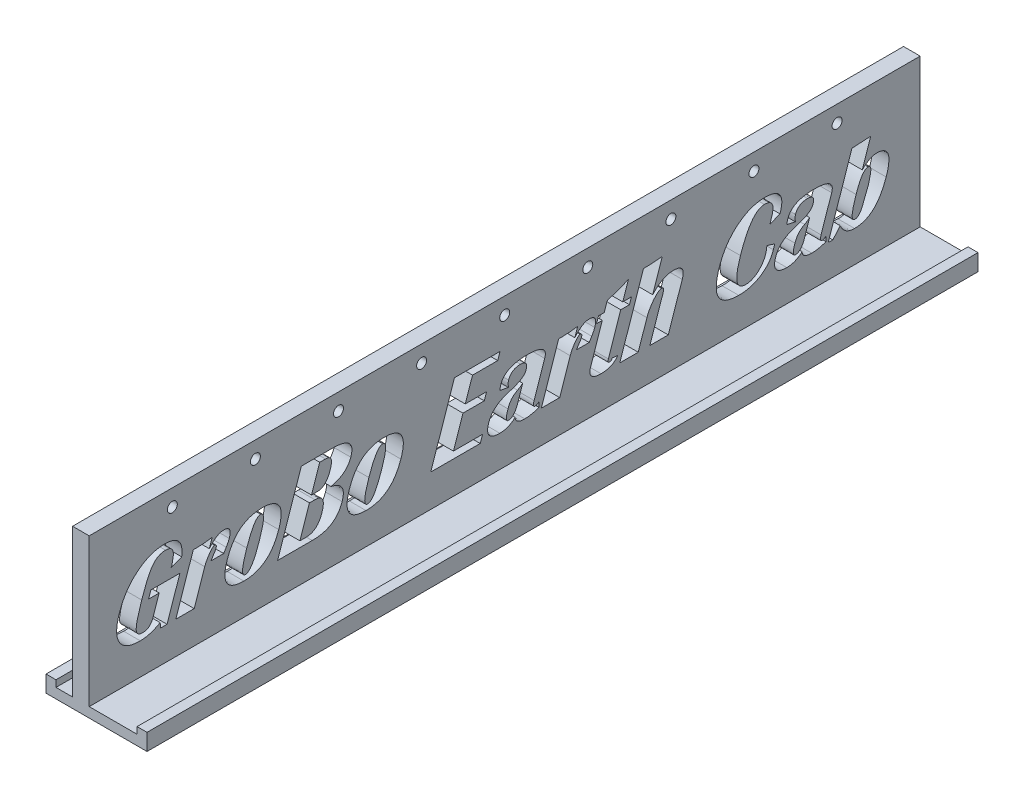
from build123d import *

# Parameters (mm, degrees)
BOSS_EXTRUDE1_DEPTH = 500
SKETCH4_R           = 3
CUT_EXTRUDE3_DEPTH  = 10
LPATTERN2_COUNT     = 9
LPATTERN2_PITCH     = 50
CUT_EXTRUDE4_DEPTH  = 10


with BuildPart() as part:
    # Sketch1 → Boss-Extrude1 (new body)
    with BuildSketch(Plane.XY):
        Polygon((0, 10), (0, 0), (60.8, 0), (60.8, 10), (54.8, 10), (54.8, 6), (26, 6), (26, 95), (16, 95), (16, 6), (6, 6), (6, 10), align=None)
    extrude(amount=BOSS_EXTRUDE1_DEPTH)

    # Sketch4 → Cut-Extrude3 (cut)
    with BuildSketch(Plane(origin=(26, 0, 0), x_dir=(0, 0, -1), z_dir=(1, 0, 0))):
        with Locations((-450, 85)):
            Circle(SKETCH4_R)
    cut_extrude3 = extrude(amount=-CUT_EXTRUDE3_DEPTH, mode=Mode.SUBTRACT)

    # LPattern2: Cut-Extrude3 ×9
    with Locations(*[(0, 0, -i * LPATTERN2_PITCH) for i in range(1, LPATTERN2_COUNT)]):
        add(cut_extrude3, mode=Mode.SUBTRACT)

    # Sketch5 → Cut-Extrude4 (cut)
    # profile 1 of 13: a face of its own
    with BuildSketch(Plane(origin=(26, 0, 0), x_dir=(0, 0, -1), z_dir=(1, 0, 0))):
        with BuildLine():
            Line((-462.923529377, 48.238675639), (-445.423529377, 48.238675639))
            Line((-445.423529377, 48.238675639), (-453.152696044, 25.488675639))
            Line((-453.152696044, 25.488675639), (-456.980821044, 25.488675639))
            Line((-456.980821044, 25.488675639), (-457.290716877, 28.414456889))
            add(Edge.make_bspline(
                [(-457.290716877, 28.414456889), (-457.807034109, 28.134602147), (-458.823107757, 27.583868971), (-460.374973912, 26.882376853), (-461.895975621, 26.260591913), (-463.405047691, 25.769835121), (-464.893151418, 25.383087761), (-466.361116894, 25.110676541), (-467.810848716, 24.937183598), (-468.7715819, 24.915913292), (-469.249050211, 24.905342305)],
                knots=[0, 0, 0, 0, 1.118551128, 2.20122486, 3.242793456, 4.247737074, 5.22207397, 6.170056537, 7.09054873, 8, 8, 8, 8], degree=3))
            add(Edge.make_bspline(
                [(-469.249050211, 24.905342305), (-469.997143944, 24.923138212), (-471.434178562, 24.957322879), (-473.499792329, 25.208077886), (-475.373227049, 25.642369029), (-477.06599192, 26.240434722), (-478.56714061, 27.026078417), (-479.875800304, 27.995315202), (-481.009819918, 29.124566867), (-481.923282128, 30.444874563), (-482.636917016, 31.91861489), (-483.151682147, 33.535417973), (-483.432603434, 35.297384974), (-483.523704872, 37.192794584), (-483.383863332, 39.229372745), (-483.034356926, 41.402956541), (-482.502088878, 43.724946712), (-481.991815082, 45.29223242), (-481.726914794, 46.105863139)],
                knots=[0, 0, 0, 0, 1.173851469, 2.25488481, 3.258722454, 4.186243485, 5.064932749, 5.906948539, 6.732937446, 7.564904307, 8.413575601, 9.294164289, 10.217509489, 11.20559843, 12.266156264, 13.414527148, 14.657794092, 16, 16, 16, 16], degree=3))
            add(Edge.make_bspline(
                [(-481.726914794, 46.105863139), (-481.437007156, 46.909238839), (-480.864066788, 48.496938883), (-479.824643807, 50.778019684), (-478.670221278, 52.948214029), (-477.367282461, 54.992761976), (-475.950360961, 56.932989697), (-474.380087491, 58.740096607), (-472.693175494, 60.439744879), (-470.888167736, 62.010866489), (-468.992561812, 63.421807693), (-467.051432075, 64.674335944), (-465.052416155, 65.71448717), (-463.01805155, 66.576384439), (-460.940944316, 67.246541691), (-458.823231692, 67.717160276), (-456.667832722, 68.025040913), (-455.213636935, 68.056308318), (-454.483425211, 68.072008972)],
                knots=[0, 0, 0, 0, 1.097867491, 2.169700011, 3.220166006, 4.25630982, 5.284616829, 6.306708197, 7.33160313, 8.361763814, 9.380654501, 10.367957179, 11.329056601, 12.274505217, 13.206073398, 14.131122465, 15.061559455, 16, 16, 16, 16], degree=3))
            add(Edge.make_bspline(
                [(-454.483425211, 68.072008972), (-454.015266548, 68.063502852), (-453.110234271, 68.04705904), (-451.80390254, 67.914690758), (-450.604332693, 67.673394531), (-449.500155549, 67.362563739), (-448.501406581, 66.939466075), (-447.599574777, 66.432034622), (-446.807570021, 65.819029263), (-446.106028865, 65.129882989), (-445.527539511, 64.326413399), (-445.042925596, 63.443065984), (-444.667729695, 62.461144982), (-444.397400358, 61.390202682), (-444.227270592, 60.226764089), (-444.155729871, 58.970414971), (-444.194750385, 57.623221118), (-444.29585765, 56.699502546), (-444.348008544, 56.223050639)],
                knots=[0, 0, 0, 0, 1.216539869, 2.351783563, 3.40626211, 4.393193257, 5.327295304, 6.218467352, 7.074386484, 7.922991183, 8.764699391, 9.637423358, 10.53476469, 11.488415989, 12.502297422, 13.585816583, 14.754769764, 16, 16, 16, 16], degree=3))
            Line((-444.348008544, 56.223050639), (-450.874050211, 53.661852722))
            Line((-450.874050211, 53.661852722), (-450.236029377, 54.655342305))
            Line((-450.236029377, 54.655342305), (-449.862331461, 56.897529805))
            add(Edge.make_bspline(
                [(-449.862331461, 56.897529805), (-449.785920338, 57.206649331), (-449.639133386, 57.800472736), (-449.48293725, 58.670918486), (-449.38944876, 59.480771194), (-449.359552044, 60.233555968), (-449.392613579, 60.92683281), (-449.49302556, 61.562482643), (-449.650975497, 62.14268143), (-449.89302714, 62.654918841), (-450.186566402, 63.115423015), (-450.554870766, 63.505208705), (-450.981232669, 63.844046081), (-451.481935349, 64.104598787), (-452.042277706, 64.314302078), (-452.665698652, 64.468810299), (-453.353547976, 64.5599023), (-453.832962682, 64.567865847), (-454.082383544, 64.572008972)],
                knots=[0, 0, 0, 0, 1.425519488, 2.738445055, 3.956834834, 5.073122937, 6.108470738, 7.059011787, 7.950370333, 8.790310664, 9.586474188, 10.385422321, 11.180073441, 12.013932376, 12.900815628, 13.854369801, 14.883711897, 16, 16, 16, 16], degree=3))
            add(Edge.make_bspline(
                [(-454.082383544, 64.572008972), (-454.456822618, 64.559367123), (-455.195014241, 64.534444226), (-456.279015881, 64.347975895), (-457.315413945, 64.039739133), (-458.297905171, 63.59410213), (-459.23573372, 63.034479762), (-460.124109155, 62.346888475), (-460.953022997, 61.52593322), (-461.754356245, 60.577772313), (-462.523366244, 59.450889072), (-463.305836406, 58.129933747), (-464.112669695, 56.598868797), (-464.940927632, 54.852786525), (-465.786570901, 52.890957252), (-466.645616497, 50.71095932), (-467.542219919, 48.324729422), (-468.119773748, 46.654162922), (-468.419623127, 45.786852722)],
                knots=[0, 0, 0, 0, 0.711556635, 1.402805378, 2.08435864, 2.761689589, 3.448119859, 4.156293033, 4.891460894, 5.662031076, 6.512781243, 7.481510693, 8.579571304, 9.801531164, 11.154492881, 12.639929041, 14.255547556, 16, 16, 16, 16], degree=3))
            add(Edge.make_bspline(
                [(-468.419623127, 45.786852722), (-468.690373834, 44.979788011), (-469.209009981, 43.433816306), (-469.897537642, 41.20507909), (-470.488373401, 39.183977938), (-470.952995297, 37.361598853), (-471.32388205, 35.747042626), (-471.579362889, 34.330150733), (-471.707303754, 33.114475135), (-471.751737845, 32.086122455), (-471.665953465, 31.208483923), (-471.454856044, 30.459988966), (-471.143523465, 29.807695938), (-470.673436687, 29.300245778), (-470.11530367, 28.879069509), (-469.422867987, 28.607165717), (-468.626264883, 28.428181562), (-468.056199242, 28.413250621), (-467.754258544, 28.405342305)],
                knots=[0, 0, 0, 0, 2.011714535, 3.853537027, 5.51243933, 6.987459781, 8.297393381, 9.427070204, 10.387301812, 11.184585839, 11.85618591, 12.460767117, 13.01628735, 13.545184736, 14.079416327, 14.655483702, 15.287864131, 16, 16, 16, 16], degree=3))
            add(Edge.make_bspline(
                [(-467.754258544, 28.405342305), (-467.391408393, 28.42048842), (-466.684178006, 28.450009676), (-465.664185404, 28.698301349), (-464.739427712, 29.132420394), (-463.884199114, 29.705710269), (-463.142946649, 30.479122211), (-462.473471432, 31.396196817), (-461.897705623, 32.485379631), (-461.601639839, 33.283798896), (-461.446966877, 33.700915222)],
                knots=[0, 0, 0, 0, 0.980863606, 1.911798979, 2.816495171, 3.732950069, 4.680285781, 5.697892679, 6.797315407, 8, 8, 8, 8], degree=3))
            Line((-461.446966877, 33.700915222), (-457.892279377, 44.155342305))
            Line((-457.892279377, 44.155342305), (-464.308946044, 44.155342305))
            Line((-464.308946044, 44.155342305), (-462.923529377, 48.238675639))
        make_face()
    # profile 2 of 13: a face of its own
    with BuildSketch(Plane(origin=(26, 0, 0), x_dir=(0, 0, -1), z_dir=(1, 0, 0))):
        with BuildLine():
            Line((-419.064154377, 45.322008972), (-426.747748127, 45.322008972))
            add(Edge.make_bspline(
                [(-426.747748127, 45.322008972), (-426.575715912, 45.608309844), (-426.253894119, 46.143894763), (-425.789931691, 46.877866166), (-425.388922843, 47.49907792), (-425.126674505, 47.862847183), (-425.006862711, 48.029040222)],
                knots=[0, 0, 0, 0, 1.244874051, 2.328794053, 3.236486356, 4, 4, 4, 4], degree=3))
            add(Edge.make_bspline(
                [(-425.006862711, 48.029040222), (-424.858422834, 48.233847623), (-424.573871524, 48.626452465), (-424.206917145, 49.217924827), (-423.92066271, 49.782876973), (-423.779474703, 50.157544375), (-423.712591877, 50.335029805)],
                knots=[0, 0, 0, 0, 1.143064377, 2.191193324, 3.143141809, 4, 4, 4, 4], degree=3))
            add(Edge.make_bspline(
                [(-423.712591877, 50.335029805), (-423.664034679, 50.489040753), (-423.574628376, 50.772614557), (-423.492648012, 51.179507922), (-423.491590655, 51.528444252), (-423.544371049, 51.824171777), (-423.693936403, 52.05063467), (-423.90625562, 52.210083054), (-424.183598514, 52.316283991), (-424.392015039, 52.319989957), (-424.505560627, 52.322008972)],
                knots=[0, 0, 0, 0, 1.461138339, 2.69033184, 3.734784726, 4.60829083, 5.363019644, 6.127198478, 6.979695349, 8, 8, 8, 8], degree=3))
            add(Edge.make_bspline(
                [(-424.505560627, 52.322008972), (-424.60404666, 52.315214443), (-424.817653813, 52.300477733), (-425.136323655, 52.153401337), (-425.4896101, 51.954090927), (-425.855424528, 51.656096471), (-426.254371608, 51.287773585), (-426.665170182, 50.828559316), (-427.118620343, 50.301127705), (-427.725343604, 49.474460191), (-428.475005562, 48.387515932), (-429.258904524, 47.010395195), (-429.940457832, 45.602831075), (-430.298063636, 44.629487033), (-430.475612711, 44.146227722)],
                knots=[0, 0, 0, 0, 0.338308942, 0.733761006, 1.194388994, 1.739996634, 2.356085563, 3.068823225, 3.865342818, 4.75703659, 6.60756462, 8.421422893, 10.223258548, 12, 12, 12, 12], degree=3))
            Line((-430.475612711, 44.146227722), (-436.819362711, 25.488675639))
            Line((-436.819362711, 25.488675639), (-447.902696044, 25.488675639))
            Line((-447.902696044, 25.488675639), (-437.393581461, 56.405342305))
            Line((-437.393581461, 56.405342305), (-435.233425211, 56.405342305))
            add(Edge.make_bspline(
                [(-435.233425211, 56.405342305), (-434.564825727, 56.418393459), (-433.159435075, 56.445826878), (-430.954643964, 56.596820314), (-428.556571398, 56.854701879), (-426.89896558, 57.092734532), (-426.036810627, 57.216540222)],
                knots=[0, 0, 0, 0, 0.868376822, 1.825320985, 2.868904619, 4, 4, 4, 4], degree=3))
            Line((-426.036810627, 57.216540222), (-427.750352294, 52.167061055))
            add(Edge.make_bspline(
                [(-427.750352294, 52.167061055), (-427.376238087, 52.594601165), (-426.658225733, 53.415150277), (-425.531698961, 54.515966198), (-424.420886469, 55.446383623), (-423.336389138, 56.223112758), (-422.265293802, 56.826006715), (-421.207988322, 57.248321765), (-420.168937905, 57.524358568), (-419.475901916, 57.556362159), (-419.137071044, 57.572008972)],
                knots=[0, 0, 0, 0, 1.301636123, 2.498143075, 3.605399216, 4.61962079, 5.551559049, 6.413976809, 7.224580497, 8, 8, 8, 8], degree=3))
            add(Edge.make_bspline(
                [(-419.137071044, 57.572008972), (-418.91818123, 57.565581846), (-418.500712266, 57.553323963), (-417.901928359, 57.493459903), (-417.361456559, 57.379489512), (-416.885034669, 57.200373879), (-416.45535787, 56.995148285), (-416.09228144, 56.728639309), (-415.780028964, 56.42159046), (-415.533656471, 56.06286504), (-415.345886059, 55.653044441), (-415.238373415, 55.194515278), (-415.154082811, 54.694890054), (-415.169403079, 54.146859383), (-415.208413392, 53.55193623), (-415.323066231, 52.911856277), (-415.499788899, 52.225485628), (-415.649791869, 51.756176618), (-415.728216877, 51.510811055)],
                knots=[0, 0, 0, 0, 1.199676795, 2.288036254, 3.293812858, 4.215472003, 5.071657635, 5.894163468, 6.671097303, 7.460768606, 8.26538989, 9.125451146, 10.034240496, 11.033104465, 12.118403863, 13.300744553, 14.588767064, 16, 16, 16, 16], degree=3))
            add(Edge.make_bspline(
                [(-415.728216877, 51.510811055), (-415.831550918, 51.233155276), (-416.047772694, 50.6521732), (-416.450357784, 49.761727177), (-416.969586408, 48.827666027), (-417.351808637, 48.188947954), (-417.551133544, 47.855863139)],
                knots=[0, 0, 0, 0, 0.868546727, 1.81739448, 2.86179398, 4, 4, 4, 4], degree=3))
            add(Edge.make_bspline(
                [(-417.551133544, 47.855863139), (-417.645431649, 47.697944995), (-417.855666435, 47.34587125), (-418.199335303, 46.763974452), (-418.612537358, 46.079161833), (-418.906408648, 45.5864756), (-419.064154377, 45.322008972)],
                knots=[0, 0, 0, 0, 0.747881635, 1.667379578, 2.74788412, 4, 4, 4, 4], degree=3))
        make_face()
    # profile 3 of 13: a face of its own
    with BuildSketch(Plane(origin=(26, 0, 0), x_dir=(0, 0, -1), z_dir=(1, 0, 0))):
        with BuildLine():
            add(Edge.make_bspline(
                [(-395.858425211, 57.572008972), (-395.241149007, 57.560814065), (-394.058054078, 57.539357482), (-392.367671271, 57.349175079), (-390.839902788, 57.03397509), (-389.472251461, 56.592302532), (-388.264260798, 56.01765745), (-387.217881394, 55.314911082), (-386.346552779, 54.468770067), (-385.633721961, 53.500410673), (-385.092147519, 52.398180663), (-384.719265328, 51.170096038), (-384.515470829, 49.81716428), (-384.473038332, 48.339435688), (-384.614291164, 46.738383389), (-384.900269792, 45.010915402), (-385.34972678, 43.156079599), (-385.756952459, 41.895428973), (-385.969102294, 41.238675639)],
                knots=[0, 0, 0, 0, 1.229247068, 2.356021443, 3.382708377, 4.331935857, 5.211636368, 6.039164321, 6.8309341, 7.618924968, 8.422745332, 9.265012565, 10.165451544, 11.140262277, 12.202712173, 13.361787333, 14.625586715, 16, 16, 16, 16], degree=3))
            add(Edge.make_bspline(
                [(-385.969102294, 41.238675639), (-386.2039902, 40.576255621), (-386.663991741, 39.278980535), (-387.478362383, 37.424901696), (-388.374675598, 35.703212186), (-389.326113851, 34.093435114), (-390.380897656, 32.630852267), (-391.491113588, 31.274542958), (-392.699259187, 30.067284116), (-393.969887628, 28.970802483), (-395.325255104, 28.010200706), (-396.76036018, 27.179960786), (-398.272425281, 26.473365263), (-399.862613141, 25.900488515), (-401.527397606, 25.453102302), (-403.267880435, 25.135947902), (-405.08700049, 24.940137348), (-406.327541998, 24.917091438), (-406.959987711, 24.905342305)],
                knots=[0, 0, 0, 0, 1.175065552, 2.301233694, 3.382913599, 4.419814754, 5.425063526, 6.395650903, 7.347709817, 8.277394233, 9.199369194, 10.121358154, 11.046477625, 11.986695364, 12.944323502, 13.925912684, 14.942600774, 16, 16, 16, 16], degree=3))
            add(Edge.make_bspline(
                [(-406.959987711, 24.905342305), (-407.577299004, 24.916372695), (-408.760461186, 24.937513958), (-410.456303448, 25.130520327), (-411.9913222, 25.440469294), (-413.364188329, 25.885451271), (-414.572904781, 26.459101246), (-415.618823678, 27.165516251), (-416.499400321, 28.00524449), (-417.211616222, 28.977366171), (-417.753767015, 30.079052793), (-418.126287098, 31.307277623), (-418.331003433, 32.660230958), (-418.369722059, 34.137454101), (-418.244224077, 35.739481789), (-417.953483658, 37.466349906), (-417.505463556, 39.321296219), (-417.098028088, 40.58193071), (-416.885768961, 41.238675639)],
                knots=[0, 0, 0, 0, 1.228038986, 2.353705987, 3.391218502, 4.339513098, 5.218349054, 6.045063728, 6.840410309, 7.627626754, 8.430657137, 9.272096605, 10.171650648, 11.145503354, 12.206444081, 13.364380122, 14.626937465, 16, 16, 16, 16], degree=3))
            add(Edge.make_bspline(
                [(-416.885768961, 41.238675639), (-416.650967643, 41.901151079), (-416.191135676, 43.198534704), (-415.375549749, 45.051835674), (-414.482857799, 46.777698728), (-413.516090147, 48.377446608), (-412.477053169, 49.853582456), (-411.352718337, 51.195649413), (-410.155834868, 52.416537494), (-408.874894943, 53.50609559), (-407.512933656, 54.464871472), (-406.07645491, 55.297707411), (-404.564127588, 56.00375179), (-402.97145071, 56.578490395), (-401.299967594, 57.024058094), (-399.553453435, 57.340662269), (-397.731426732, 57.53732545), (-396.490875752, 57.560297496), (-395.858425211, 57.572008972)],
                knots=[0, 0, 0, 0, 1.17379807, 2.298751473, 3.379264627, 4.417667667, 5.418890693, 6.391680266, 7.339143885, 8.271686748, 9.196811248, 10.117805706, 11.0419273, 11.981130875, 12.942627758, 13.928149894, 14.943741336, 16, 16, 16, 16], degree=3))
        make_face()
        with BuildLine():
            add(Edge.make_bspline(
                [(-396.879258544, 54.655342305), (-397.038304716, 54.643393402), (-397.366468427, 54.618738949), (-397.857086628, 54.455214322), (-398.343300564, 54.180271561), (-398.84046325, 53.810824904), (-399.33739645, 53.33005922), (-399.851494984, 52.755058535), (-400.355493077, 52.064651893), (-400.879321376, 51.280937101), (-401.392158757, 50.383512057), (-401.923825355, 49.387887525), (-402.456562823, 48.284917448), (-403.007480173, 47.081347416), (-403.548369736, 45.767524079), (-404.106118437, 44.352207133), (-404.67130355, 42.833836455), (-405.033097808, 41.780310812), (-405.219102294, 41.238675639)],
                knots=[0, 0, 0, 0, 0.465798473, 0.96109295, 1.498705268, 2.096703288, 2.770241422, 3.520316646, 4.353229604, 5.271341494, 6.280187857, 7.378906499, 8.576821054, 9.867090618, 11.255275713, 12.73753087, 14.322709995, 16, 16, 16, 16], degree=3))
            add(Edge.make_bspline(
                [(-405.219102294, 41.238675639), (-405.400161062, 40.698477571), (-405.750098689, 39.65442082), (-406.22638139, 38.136492233), (-406.624407367, 36.717762154), (-406.976397005, 35.410969376), (-407.251916847, 34.203564479), (-407.45703242, 33.101961317), (-407.626802378, 32.107443683), (-407.693201922, 31.213661744), (-407.717933127, 30.425661431), (-407.682519231, 29.739057587), (-407.560483066, 29.158652144), (-407.399202432, 28.670827413), (-407.145279166, 28.291962095), (-406.827317887, 28.013101458), (-406.432696308, 27.851460993), (-406.150251713, 27.832103784), (-406.002956461, 27.822008972)],
                knots=[0, 0, 0, 0, 1.867939927, 3.610222641, 5.215197755, 6.698700538, 8.047097408, 9.273972599, 10.372859214, 11.352294881, 12.209181684, 12.957923034, 13.598694019, 14.150165215, 14.630885378, 15.076025384, 15.51814594, 16, 16, 16, 16], degree=3))
            add(Edge.make_bspline(
                [(-406.002956461, 27.822008972), (-405.840776371, 27.833587256), (-405.509358585, 27.857247677), (-405.014192362, 28.024390124), (-404.522057189, 28.294019851), (-404.023744919, 28.666973296), (-403.526625373, 29.147221182), (-403.012014065, 29.722006963), (-402.509678993, 30.415499653), (-401.973330968, 31.192970198), (-401.464983577, 32.096803131), (-400.920077999, 33.086756191), (-400.388107909, 34.190663773), (-399.84965444, 35.398366607), (-399.305689217, 36.709468894), (-398.748992243, 38.125249755), (-398.183502007, 39.643485843), (-397.821751139, 40.697030626), (-397.635768961, 41.238675639)],
                knots=[0, 0, 0, 0, 0.47398303, 0.968592427, 1.513273463, 2.110444346, 2.783050859, 3.532088596, 4.363849489, 5.285630575, 6.293081526, 7.394482706, 8.590740334, 9.875573513, 11.261838504, 12.74204344, 14.325029983, 16, 16, 16, 16], degree=3))
            add(Edge.make_bspline(
                [(-397.635768961, 41.238675639), (-397.454304516, 41.778757959), (-397.103582826, 42.822591002), (-396.632486525, 44.34287104), (-396.216116614, 45.756443192), (-395.879823466, 47.067710197), (-395.608270488, 48.275219078), (-395.377844085, 49.372229537), (-395.246599535, 50.372391224), (-395.159239527, 51.262770363), (-395.13240741, 52.052627554), (-395.188663221, 52.736258567), (-395.288937157, 53.321606635), (-395.465505684, 53.807917052), (-395.727897275, 54.183012515), (-396.045427835, 54.464555386), (-396.443363476, 54.626993279), (-396.728902954, 54.645563726), (-396.879258544, 54.655342305)],
                knots=[0, 0, 0, 0, 1.865850032, 3.606183439, 5.212108544, 6.691444057, 8.03833231, 9.265731815, 10.360498967, 11.339698587, 12.195626685, 12.944258019, 13.5823757, 14.136723438, 14.622542498, 15.06718447, 15.508810371, 16, 16, 16, 16], degree=3))
        make_face(mode=Mode.SUBTRACT)
    # profile 4 of 13: a face of its own
    with BuildSketch(Plane(origin=(26, 0, 0), x_dir=(0, 0, -1), z_dir=(1, 0, 0))):
        with BuildLine():
            Line((-386.652696044, 25.488675639), (-372.379258544, 67.488675639))
            Line((-372.379258544, 67.488675639), (-353.639675211, 67.488675639))
            add(Edge.make_bspline(
                [(-353.639675211, 67.488675639), (-353.05915741, 67.482978402), (-351.942372545, 67.472018207), (-350.335376794, 67.352848022), (-348.866757943, 67.158568663), (-347.541042328, 66.877660258), (-346.352805774, 66.523611688), (-345.301243116, 66.095487266), (-344.392336277, 65.567942977), (-343.619999157, 64.968642298), (-342.984582788, 64.286009088), (-342.50365342, 63.514197676), (-342.162411222, 62.662385609), (-341.966124713, 61.732037983), (-341.898821321, 60.724278269), (-342.008389755, 59.642606876), (-342.220896764, 58.476515568), (-342.471058763, 57.691153534), (-342.601914794, 57.280342305)],
                knots=[0, 0, 0, 0, 1.485621751, 2.858000022, 4.121638237, 5.274700549, 6.322701076, 7.291762734, 8.17338372, 9.004114968, 9.785635429, 10.547287957, 11.318409231, 12.122244262, 12.971620071, 13.892526738, 14.897612001, 16, 16, 16, 16], degree=3))
            add(Edge.make_bspline(
                [(-342.601914794, 57.280342305), (-342.709956752, 56.983851783), (-342.924628032, 56.394747321), (-343.320547578, 55.550794938), (-343.75692539, 54.739000455), (-344.262171372, 53.974570469), (-344.816350268, 53.244109003), (-345.428716387, 52.557967735), (-346.098744617, 51.92183623), (-346.812478297, 51.313232434), (-347.586855757, 50.750495061), (-348.418246578, 50.229702469), (-349.306821061, 49.756830136), (-350.247331971, 49.319770109), (-351.240536462, 48.916417514), (-352.292683552, 48.565366893), (-353.394660804, 48.241124852), (-354.155084057, 48.0703597), (-354.542018961, 47.983467305)],
                knots=[0, 0, 0, 0, 0.952929994, 1.893400523, 2.81349351, 3.735096158, 4.658525393, 5.581635235, 6.509978298, 7.447847244, 8.413555848, 9.39916916, 10.409393355, 11.452444208, 12.531387913, 13.646013535, 14.802194012, 16, 16, 16, 16], degree=3))
            add(Edge.make_bspline(
                [(-354.542018961, 47.983467305), (-354.148594476, 47.891861434), (-353.388214629, 47.714812822), (-352.30970948, 47.36673983), (-351.32952194, 46.968127074), (-350.449602426, 46.512188438), (-349.668893638, 46.00473758), (-348.995247528, 45.43175152), (-348.419805267, 44.811222447), (-347.928993496, 44.139152554), (-347.574083749, 43.392689547), (-347.290451472, 42.604170703), (-347.130845925, 41.755546131), (-347.071978873, 40.856870631), (-347.096076702, 39.903355913), (-347.241799364, 38.89763105), (-347.477632697, 37.836420564), (-347.706261802, 37.123313718), (-347.824571044, 36.754300639)],
                knots=[0, 0, 0, 0, 1.254203461, 2.424025637, 3.515768501, 4.537180265, 5.497712647, 6.401501271, 7.276250524, 8.122016202, 8.97449358, 9.833992916, 10.718611784, 11.645745398, 12.627550143, 13.67517221, 14.796965889, 16, 16, 16, 16], degree=3))
            add(Edge.make_bspline(
                [(-347.824571044, 36.754300639), (-347.990154444, 36.29546888), (-348.31545213, 35.394068683), (-348.92475072, 34.117912691), (-349.597757403, 32.920429076), (-350.366020339, 31.82018091), (-351.205945182, 30.80057403), (-352.133797423, 29.872566318), (-353.145194024, 29.039985872), (-354.227999998, 28.280374505), (-355.401885539, 27.628278615), (-356.650109916, 27.052377881), (-357.983375175, 26.568825519), (-359.39350161, 26.169303822), (-360.886057529, 25.859653961), (-362.457289843, 25.643187746), (-364.110213382, 25.515830683), (-365.239276086, 25.497864708), (-365.816758544, 25.488675639)],
                knots=[0, 0, 0, 0, 1.022095522, 2.007962804, 2.960764516, 3.898998471, 4.817302134, 5.727105781, 6.645409443, 7.560681698, 8.49612235, 9.456600375, 10.439954105, 11.466248627, 12.526837531, 13.633020507, 14.789359413, 16, 16, 16, 16], degree=3))
            Line((-365.816758544, 25.488675639), (-386.652696044, 25.488675639))
        make_face()
        with BuildLine():
            Line((-373.208685627, 28.988675639), (-369.736029377, 28.988675639))
            add(Edge.make_bspline(
                [(-369.736029377, 28.988675639), (-369.446952761, 28.991516824), (-368.882113623, 28.997068337), (-368.055813321, 29.111342137), (-367.256629156, 29.245733342), (-366.496555848, 29.469586925), (-365.764152752, 29.741450784), (-365.074613272, 30.090547681), (-364.415802115, 30.496117472), (-363.779420407, 30.946008719), (-363.200698299, 31.485658665), (-362.638523122, 32.066401926), (-362.120738235, 32.720883847), (-361.627690516, 33.42671385), (-361.181215987, 34.201771559), (-360.763289236, 35.033152461), (-360.365702315, 35.923627315), (-360.148844976, 36.551952938), (-360.038112711, 36.872790222)],
                knots=[0, 0, 0, 0, 1.028092588, 2.008833989, 2.965663052, 3.910618571, 4.824672251, 5.743768055, 6.656476737, 7.578178469, 8.512425225, 9.468765049, 10.4536136, 11.47976972, 12.531656215, 13.634581789, 14.792163923, 16, 16, 16, 16], degree=3))
            add(Edge.make_bspline(
                [(-360.038112711, 36.872790222), (-359.918630867, 37.236144284), (-359.689329719, 37.933467834), (-359.422806085, 38.958933854), (-359.238405584, 39.914705327), (-359.132807743, 40.801591796), (-359.116023729, 41.615891132), (-359.159190787, 42.361203617), (-359.311374607, 43.033578079), (-359.523972149, 43.643061731), (-359.831835763, 44.181336648), (-360.214141553, 44.650289977), (-360.685693204, 45.042936616), (-361.23521431, 45.360283883), (-361.866366597, 45.604843684), (-362.571779174, 45.789981796), (-363.362453006, 45.883377149), (-363.914647181, 45.897798886), (-364.203477294, 45.905342305)],
                knots=[0, 0, 0, 0, 1.477223888, 2.834984147, 4.089401374, 5.235073522, 6.279826315, 7.233033148, 8.110085452, 8.934271843, 9.717413368, 10.492778076, 11.259119855, 12.074316839, 12.932959627, 13.866603934, 14.884108063, 16, 16, 16, 16], degree=3))
            Line((-364.203477294, 45.905342305), (-367.466498127, 45.905342305))
            Line((-367.466498127, 45.905342305), (-373.208685627, 28.988675639))
        make_face(mode=Mode.SUBTRACT)
        with BuildLine():
            Line((-366.272487711, 49.405342305), (-362.517279377, 49.405342305))
            add(Edge.make_bspline(
                [(-362.517279377, 49.405342305), (-362.110328545, 49.426911606), (-361.307528, 49.469461822), (-360.147674816, 49.849175977), (-359.066277089, 50.449962136), (-358.07030179, 51.300590866), (-357.166835155, 52.391075661), (-356.328501959, 53.703854455), (-355.573067879, 55.257374956), (-355.160215456, 56.391920122), (-354.943060627, 56.988675639)],
                knots=[0, 0, 0, 0, 0.849006126, 1.674852407, 2.525188669, 3.422434471, 4.39615858, 5.476450165, 6.672646685, 8, 8, 8, 8], degree=3))
            add(Edge.make_bspline(
                [(-354.943060627, 56.988675639), (-354.852625391, 57.270504785), (-354.678650349, 57.812674402), (-354.465254565, 58.605269897), (-354.320440656, 59.345826382), (-354.223997217, 60.030104476), (-354.193212384, 60.662199812), (-354.230621615, 61.239255608), (-354.315859179, 61.764989902), (-354.473435347, 62.233779401), (-354.68222729, 62.653047786), (-354.960707362, 63.015074464), (-355.303065058, 63.317473133), (-355.700722684, 63.565607006), (-356.158232143, 63.760830517), (-356.677927321, 63.891523611), (-357.255487819, 63.97487893), (-357.658892846, 63.983953072), (-357.868841877, 63.988675639)],
                knots=[0, 0, 0, 0, 1.506678831, 2.898477659, 4.175458047, 5.34569909, 6.413884814, 7.390226299, 8.285271883, 9.11672258, 9.898346833, 10.65934739, 11.426141061, 12.211429198, 13.035946203, 13.947542363, 14.931814275, 16, 16, 16, 16], degree=3))
            Line((-357.868841877, 63.988675639), (-361.314154377, 63.988675639))
            Line((-361.314154377, 63.988675639), (-366.272487711, 49.405342305))
        make_face(mode=Mode.SUBTRACT)
    # profile 5 of 13: a face of its own
    with BuildSketch(Plane(origin=(26, 0, 0), x_dir=(0, 0, -1), z_dir=(1, 0, 0))):
        with BuildLine():
            add(Edge.make_bspline(
                [(-322.358425211, 57.572008972), (-321.741149007, 57.560814065), (-320.558054078, 57.539357482), (-318.867671271, 57.349175079), (-317.339902788, 57.03397509), (-315.972251461, 56.592302532), (-314.764260798, 56.01765745), (-313.717881394, 55.314911082), (-312.846552779, 54.468770067), (-312.133721961, 53.500410673), (-311.592147519, 52.398180663), (-311.219265328, 51.170096038), (-311.015470829, 49.81716428), (-310.973038332, 48.339435688), (-311.114291164, 46.738383389), (-311.400269792, 45.010915402), (-311.84972678, 43.156079599), (-312.256952459, 41.895428973), (-312.469102294, 41.238675639)],
                knots=[0, 0, 0, 0, 1.229247068, 2.356021443, 3.382708377, 4.331935857, 5.211636368, 6.039164321, 6.8309341, 7.618924968, 8.422745332, 9.265012565, 10.165451544, 11.140262277, 12.202712173, 13.361787333, 14.625586715, 16, 16, 16, 16], degree=3))
            add(Edge.make_bspline(
                [(-312.469102294, 41.238675639), (-312.7039902, 40.576255621), (-313.163991741, 39.278980535), (-313.978362383, 37.424901696), (-314.874675598, 35.703212186), (-315.826113851, 34.093435114), (-316.880897656, 32.630852267), (-317.991113588, 31.274542958), (-319.199259187, 30.067284116), (-320.469887628, 28.970802483), (-321.825255104, 28.010200706), (-323.26036018, 27.179960786), (-324.772425281, 26.473365263), (-326.362613141, 25.900488515), (-328.027397606, 25.453102302), (-329.767880435, 25.135947902), (-331.58700049, 24.940137348), (-332.827541998, 24.917091438), (-333.459987711, 24.905342305)],
                knots=[0, 0, 0, 0, 1.175065552, 2.301233694, 3.382913599, 4.419814754, 5.425063526, 6.395650903, 7.347709817, 8.277394233, 9.199369194, 10.121358154, 11.046477625, 11.986695364, 12.944323502, 13.925912684, 14.942600774, 16, 16, 16, 16], degree=3))
            add(Edge.make_bspline(
                [(-333.459987711, 24.905342305), (-334.077299004, 24.916372695), (-335.260461186, 24.937513958), (-336.956303448, 25.130520327), (-338.4913222, 25.440469294), (-339.864188329, 25.885451271), (-341.072904781, 26.459101246), (-342.118823678, 27.165516251), (-342.999400321, 28.00524449), (-343.711616222, 28.977366171), (-344.253767015, 30.079052793), (-344.626287098, 31.307277623), (-344.831003433, 32.660230958), (-344.869722059, 34.137454101), (-344.744224077, 35.739481789), (-344.453483658, 37.466349906), (-344.005463556, 39.321296219), (-343.598028088, 40.58193071), (-343.385768961, 41.238675639)],
                knots=[0, 0, 0, 0, 1.228038986, 2.353705987, 3.391218502, 4.339513098, 5.218349054, 6.045063728, 6.840410309, 7.627626754, 8.430657137, 9.272096605, 10.171650648, 11.145503354, 12.206444081, 13.364380122, 14.626937465, 16, 16, 16, 16], degree=3))
            add(Edge.make_bspline(
                [(-343.385768961, 41.238675639), (-343.150967643, 41.901151079), (-342.691135676, 43.198534704), (-341.875549749, 45.051835674), (-340.982857799, 46.777698728), (-340.016090147, 48.377446608), (-338.977053169, 49.853582456), (-337.852718337, 51.195649413), (-336.655834868, 52.416537494), (-335.374894943, 53.50609559), (-334.012933656, 54.464871472), (-332.57645491, 55.297707411), (-331.064127588, 56.00375179), (-329.47145071, 56.578490395), (-327.799967594, 57.024058094), (-326.053453435, 57.340662269), (-324.231426732, 57.53732545), (-322.990875752, 57.560297496), (-322.358425211, 57.572008972)],
                knots=[0, 0, 0, 0, 1.17379807, 2.298751473, 3.379264627, 4.417667667, 5.418890693, 6.391680266, 7.339143885, 8.271686748, 9.196811248, 10.117805706, 11.0419273, 11.981130875, 12.942627758, 13.928149894, 14.943741336, 16, 16, 16, 16], degree=3))
        make_face()
        with BuildLine():
            add(Edge.make_bspline(
                [(-323.379258544, 54.655342305), (-323.538304716, 54.643393402), (-323.866468427, 54.618738949), (-324.357086628, 54.455214322), (-324.843300564, 54.180271561), (-325.34046325, 53.810824904), (-325.83739645, 53.33005922), (-326.351494984, 52.755058535), (-326.855493077, 52.064651893), (-327.379321376, 51.280937101), (-327.892158757, 50.383512057), (-328.423825355, 49.387887525), (-328.956562823, 48.284917448), (-329.507480173, 47.081347416), (-330.048369736, 45.767524079), (-330.606118437, 44.352207133), (-331.17130355, 42.833836455), (-331.533097808, 41.780310812), (-331.719102294, 41.238675639)],
                knots=[0, 0, 0, 0, 0.465798473, 0.96109295, 1.498705268, 2.096703288, 2.770241422, 3.520316646, 4.353229604, 5.271341494, 6.280187857, 7.378906499, 8.576821054, 9.867090618, 11.255275713, 12.73753087, 14.322709995, 16, 16, 16, 16], degree=3))
            add(Edge.make_bspline(
                [(-331.719102294, 41.238675639), (-331.900161062, 40.698477571), (-332.250098689, 39.65442082), (-332.72638139, 38.136492233), (-333.124407367, 36.717762154), (-333.476397005, 35.410969376), (-333.751916847, 34.203564479), (-333.95703242, 33.101961317), (-334.126802378, 32.107443683), (-334.193201922, 31.213661744), (-334.217933127, 30.425661431), (-334.182519231, 29.739057587), (-334.060483066, 29.158652144), (-333.899202432, 28.670827413), (-333.645279166, 28.291962095), (-333.327317887, 28.013101458), (-332.932696308, 27.851460993), (-332.650251713, 27.832103784), (-332.502956461, 27.822008972)],
                knots=[0, 0, 0, 0, 1.867939927, 3.610222641, 5.215197755, 6.698700538, 8.047097408, 9.273972599, 10.372859214, 11.352294881, 12.209181684, 12.957923034, 13.598694019, 14.150165215, 14.630885378, 15.076025384, 15.51814594, 16, 16, 16, 16], degree=3))
            add(Edge.make_bspline(
                [(-332.502956461, 27.822008972), (-332.340776371, 27.833587256), (-332.009358585, 27.857247677), (-331.514192362, 28.024390124), (-331.022057189, 28.294019851), (-330.523744919, 28.666973296), (-330.026625373, 29.147221182), (-329.512014065, 29.722006963), (-329.009678993, 30.415499653), (-328.473330968, 31.192970198), (-327.964983577, 32.096803131), (-327.420077999, 33.086756191), (-326.888107909, 34.190663773), (-326.34965444, 35.398366607), (-325.805689217, 36.709468894), (-325.248992243, 38.125249755), (-324.683502007, 39.643485843), (-324.321751139, 40.697030626), (-324.135768961, 41.238675639)],
                knots=[0, 0, 0, 0, 0.47398303, 0.968592427, 1.513273463, 2.110444346, 2.783050859, 3.532088596, 4.363849489, 5.285630575, 6.293081526, 7.394482706, 8.590740334, 9.875573513, 11.261838504, 12.74204344, 14.325029983, 16, 16, 16, 16], degree=3))
            add(Edge.make_bspline(
                [(-324.135768961, 41.238675639), (-323.954304516, 41.778757959), (-323.603582826, 42.822591002), (-323.132486525, 44.34287104), (-322.716116614, 45.756443192), (-322.379823466, 47.067710197), (-322.108270488, 48.275219078), (-321.877844085, 49.372229537), (-321.746599535, 50.372391224), (-321.659239527, 51.262770363), (-321.63240741, 52.052627554), (-321.688663221, 52.736258567), (-321.788937157, 53.321606635), (-321.965505684, 53.807917052), (-322.227897275, 54.183012515), (-322.545427835, 54.464555386), (-322.943363476, 54.626993279), (-323.228902954, 54.645563726), (-323.379258544, 54.655342305)],
                knots=[0, 0, 0, 0, 1.865850032, 3.606183439, 5.212108544, 6.691444057, 8.03833231, 9.265731815, 10.360498967, 11.339698587, 12.195626685, 12.944258019, 13.5823757, 14.136723438, 14.622542498, 15.06718447, 15.508810371, 16, 16, 16, 16], degree=3))
        make_face(mode=Mode.SUBTRACT)
    # profile 6 of 13: a face of its own
    with BuildSketch(Plane(origin=(26, 0, 0), x_dir=(0, 0, -1), z_dir=(1, 0, 0))):
        Polygon((-252.795925211, 67.488675639), (-254.181341877, 63.405342305), (-269.348008544, 63.405342305), (-273.713893961, 50.572008972), (-260.880560627, 50.572008972), (-262.265977294, 46.488675639), (-275.099310627, 46.488675639), (-280.850612711, 29.572008972), (-263.350612711, 29.572008972), (-264.736029377, 25.488675639), (-294.486029377, 25.488675639), (-280.212591877, 67.488675639), align=None)
    # profile 7 of 13: a face of its own
    with BuildSketch(Plane(origin=(26, 0, 0), x_dir=(0, 0, -1), z_dir=(1, 0, 0))):
        with BuildLine():
            add(Edge.make_bspline(
                [(-229.353216877, 26.600654805), (-230.109100775, 26.342210716), (-231.572380517, 25.841901076), (-233.76195087, 25.315844324), (-235.853399502, 24.975396679), (-237.220947205, 24.928228033), (-237.884466877, 24.905342305)],
                knots=[0, 0, 0, 0, 1.096438446, 2.122543122, 3.089077793, 4, 4, 4, 4], degree=3))
            add(Edge.make_bspline(
                [(-237.884466877, 24.905342305), (-238.334731741, 24.913589516), (-239.178358532, 24.929041683), (-240.358226164, 25.098973716), (-241.361937608, 25.383627278), (-242.199187366, 25.782460647), (-242.857501627, 26.312052009), (-243.343367648, 26.960609671), (-243.634481949, 27.738876037), (-243.677245895, 28.296515351), (-243.699571044, 28.587633972)],
                knots=[0, 0, 0, 0, 1.394250094, 2.612299619, 3.681604072, 4.616137303, 5.465854739, 6.273499309, 7.098670974, 8, 8, 8, 8], degree=3))
            add(Edge.make_bspline(
                [(-243.699571044, 28.587633972), (-244.034314109, 28.292118216), (-244.694706364, 27.709114901), (-245.766102242, 26.966416905), (-246.866598523, 26.331875761), (-248.001836777, 25.804851843), (-249.180440563, 25.408553768), (-250.392856365, 25.111354016), (-251.642246121, 24.934814403), (-252.488517474, 24.91520899), (-252.914414794, 24.905342305)],
                knots=[0, 0, 0, 0, 1.05354736, 2.078473278, 3.071470751, 4.05048091, 5.028228712, 6.002575825, 6.994769703, 8, 8, 8, 8], degree=3))
            add(Edge.make_bspline(
                [(-252.914414794, 24.905342305), (-253.300566347, 24.911616907), (-254.044152796, 24.92369949), (-255.107215993, 25.034958376), (-256.074990613, 25.204125076), (-256.942262782, 25.444573177), (-257.710826772, 25.766747748), (-258.383119403, 26.15729503), (-258.955061698, 26.623174086), (-259.420495571, 27.165121737), (-259.790727377, 27.773322255), (-260.055667821, 28.45849125), (-260.217943201, 29.214831174), (-260.277906482, 30.039203784), (-260.237301296, 30.93153871), (-260.09524212, 31.891792137), (-259.857174757, 32.92503652), (-259.631258779, 33.626532775), (-259.513373127, 33.992581889)],
                knots=[0, 0, 0, 0, 1.304620715, 2.512221632, 3.607818634, 4.621862217, 5.546736593, 6.416631869, 7.240915559, 8.027168397, 8.819564973, 9.635622329, 10.497604322, 11.424471289, 12.421266459, 13.510300629, 14.700845172, 16, 16, 16, 16], degree=3))
            add(Edge.make_bspline(
                [(-259.513373127, 33.992581889), (-259.412079617, 34.27719937), (-259.21046672, 34.843697214), (-258.818670084, 35.655522975), (-258.383086095, 36.444524448), (-257.880838067, 37.198571673), (-257.323834427, 37.920716034), (-256.708183537, 38.608739497), (-256.035133646, 39.263566342), (-255.300998308, 39.883329613), (-254.518592949, 40.477540994), (-253.673409885, 41.03433461), (-252.771785119, 41.564476773), (-251.80539887, 42.054068251), (-250.781423791, 42.508685226), (-249.704552192, 42.935719241), (-248.573073486, 43.342403908), (-247.790252272, 43.572923113), (-247.390977294, 43.690498555)],
                knots=[0, 0, 0, 0, 0.895932749, 1.783249465, 2.671253047, 3.568998693, 4.468914995, 5.375670759, 6.306580238, 7.253249886, 8.225214829, 9.220486441, 10.255007372, 11.327607293, 12.433493681, 13.578707072, 14.765028765, 16, 16, 16, 16], degree=3))
            add(Edge.make_bspline(
                [(-247.390977294, 43.690498555), (-246.680566004, 43.904696302), (-245.331304966, 44.311515111), (-243.448817365, 45.00773851), (-241.797590024, 45.71509934), (-240.397816837, 46.479533542), (-239.232832265, 47.270194685), (-238.30661304, 48.093032672), (-237.593034602, 48.950374801), (-237.321173095, 49.592065182), (-237.191758544, 49.897529805)],
                knots=[0, 0, 0, 0, 1.44603237, 2.746402208, 3.910564404, 4.944253428, 5.851059526, 6.647821504, 7.356320889, 8, 8, 8, 8], degree=3))
            add(Edge.make_bspline(
                [(-237.191758544, 49.897529805), (-237.080920434, 50.26530154), (-236.876527326, 50.943497947), (-236.742457816, 51.926847977), (-236.848110415, 52.775309091), (-237.149058683, 53.494404533), (-237.696347123, 54.037122974), (-238.442864536, 54.403384695), (-239.375830173, 54.625024681), (-240.064501586, 54.644708368), (-240.436550211, 54.655342305)],
                knots=[0, 0, 0, 0, 1.26721943, 2.336839907, 3.247230097, 4.059641373, 4.860837845, 5.730853818, 6.774113896, 8, 8, 8, 8], degree=3))
            add(Edge.make_bspline(
                [(-240.436550211, 54.655342305), (-240.887182753, 54.642844051), (-241.74871623, 54.618949494), (-242.979291056, 54.397123586), (-244.082274462, 54.033882383), (-245.069526485, 53.531733642), (-245.921513762, 52.863996985), (-246.63556842, 52.045515077), (-247.248002903, 51.096271284), (-247.516616722, 50.377830762), (-247.655300211, 50.006904805)],
                knots=[0, 0, 0, 0, 1.167645444, 2.23234131, 3.228837679, 4.169623404, 5.089967512, 6.016360831, 6.975860583, 8, 8, 8, 8], degree=3))
            add(Edge.make_bspline(
                [(-247.655300211, 50.006904805), (-247.727968624, 49.747265981), (-247.882167386, 49.196325298), (-247.937149273, 48.281072857), (-247.889180009, 47.255450784), (-247.777978969, 46.53957784), (-247.719102294, 46.160550639)],
                knots=[0, 0, 0, 0, 0.831019779, 1.763382674, 2.815797118, 4, 4, 4, 4], degree=3))
            Line((-247.719102294, 46.160550639), (-252.923529377, 47.236071472))
            add(Edge.make_bspline(
                [(-252.923529377, 47.236071472), (-252.856786243, 47.715741744), (-252.726149108, 48.654606107), (-252.454721049, 49.562740565), (-252.321966877, 50.006904805)],
                knots=[0, 0, 0, 0, 1.02180952, 2, 2, 2, 2], degree=3))
            add(Edge.make_bspline(
                [(-252.321966877, 50.006904805), (-252.206895386, 50.316495959), (-251.979535848, 50.928189618), (-251.52818228, 51.791769307), (-250.984654848, 52.588570871), (-250.361149352, 53.329905135), (-249.657394805, 54.019549367), (-248.860897746, 54.635752294), (-247.981540235, 55.198002515), (-247.023272864, 55.705916559), (-245.971366142, 56.143047825), (-244.838094563, 56.524812995), (-243.62058148, 56.851459771), (-242.317012159, 57.113167497), (-240.933400039, 57.324158806), (-239.460525388, 57.464178165), (-237.903971847, 57.560007614), (-236.836445805, 57.56794277), (-236.289414794, 57.572008972)],
                knots=[0, 0, 0, 0, 0.835094197, 1.649988442, 2.458073729, 3.271080298, 4.09738884, 4.946239611, 5.81412628, 6.735709725, 7.686581105, 8.693006228, 9.759636701, 10.873770639, 12.055547515, 13.29930583, 14.616086723, 16, 16, 16, 16], degree=3))
            add(Edge.make_bspline(
                [(-236.289414794, 57.572008972), (-235.775893777, 57.566759946), (-234.787639945, 57.556658373), (-233.366302878, 57.480302488), (-232.065897149, 57.328272024), (-230.878540841, 57.149026946), (-229.812141376, 56.888220914), (-228.85686785, 56.599674373), (-228.028615744, 56.228525358), (-227.31036933, 55.817387908), (-226.717920571, 55.333750968), (-226.227969324, 54.805284951), (-225.884162681, 54.19938526), (-225.634130104, 53.549766735), (-225.531517348, 52.838810627), (-225.548148618, 52.078220877), (-225.662586991, 51.260277856), (-225.835589991, 50.712738212), (-225.926133544, 50.426175639)],
                knots=[0, 0, 0, 0, 1.612375176, 3.102961509, 4.466096455, 5.722265399, 6.869864671, 7.910684801, 8.850184943, 9.713994311, 10.500615135, 11.24369205, 11.961923158, 12.67423861, 13.417621608, 14.199892422, 15.057888384, 16, 16, 16, 16], degree=3))
            Line((-225.926133544, 50.426175639), (-232.306341877, 31.650133972))
            add(Edge.make_bspline(
                [(-232.306341877, 31.650133972), (-232.387244405, 31.399274736), (-232.537702106, 30.932741676), (-232.674455741, 30.270318346), (-232.735572093, 29.705231437), (-232.682556549, 29.239441931), (-232.553270031, 28.858370095), (-232.298176337, 28.579169931), (-231.935780385, 28.435845572), (-231.672481381, 28.415974431), (-231.531602294, 28.405342305)],
                knots=[0, 0, 0, 0, 1.577969068, 2.934612848, 4.048770832, 4.965492539, 5.726142785, 6.421710344, 7.155530393, 8, 8, 8, 8], degree=3))
            add(Edge.make_bspline(
                [(-231.531602294, 28.405342305), (-231.414862122, 28.421946107), (-231.131485492, 28.462250393), (-230.674429313, 28.677527177), (-230.100365148, 28.989618182), (-229.697089683, 29.263816609), (-229.471706461, 29.417061055)],
                knots=[0, 0, 0, 0, 0.608272766, 1.476529326, 2.589678762, 4, 4, 4, 4], degree=3))
            Line((-229.471706461, 29.417061055), (-229.353216877, 26.600654805))
        make_face()
        with BuildLine():
            add(Edge.make_bspline(
                [(-239.169623127, 44.073311055), (-239.653988749, 43.686027261), (-240.616682271, 42.916287247), (-241.708077252, 42.343557179), (-242.250352294, 42.058988139)],
                knots=[0, 0, 0, 0, 1.006271696, 2, 2, 2, 2], degree=3))
            add(Edge.make_bspline(
                [(-242.250352294, 42.058988139), (-242.585590635, 41.880529915), (-243.248438623, 41.52767447), (-244.167110913, 40.880253727), (-245.006430869, 40.147179706), (-245.782494681, 39.333612772), (-246.460099797, 38.41856582), (-247.06666045, 37.424176216), (-247.601578682, 36.34659882), (-247.878532207, 35.578575489), (-248.019883544, 35.186592305)],
                knots=[0, 0, 0, 0, 0.988015722, 1.953548124, 2.917913406, 3.885937426, 4.874681131, 5.875844555, 6.915875102, 8, 8, 8, 8], degree=3))
            add(Edge.make_bspline(
                [(-248.019883544, 35.186592305), (-248.177095555, 34.705147725), (-248.468592704, 33.812469606), (-248.796230453, 32.554174109), (-248.978459569, 31.483101695), (-249.028413607, 30.603263212), (-248.949508354, 29.901021871), (-248.70469816, 29.372862242), (-248.276110556, 29.035793341), (-247.934470806, 29.004869736), (-247.755560627, 28.988675639)],
                knots=[0, 0, 0, 0, 1.734384893, 3.215837308, 4.449253675, 5.449068203, 6.22755132, 6.84649404, 7.395931074, 8, 8, 8, 8], degree=3))
            add(Edge.make_bspline(
                [(-247.755560627, 28.988675639), (-247.470405566, 29.008282218), (-246.900127959, 29.04749314), (-246.077642341, 29.36021692), (-245.305138941, 29.859079199), (-244.58381577, 30.557672348), (-243.910805216, 31.448358558), (-243.272675565, 32.524214069), (-242.683278202, 33.796430899), (-242.351985625, 34.724800633), (-242.177435627, 35.213936055)],
                knots=[0, 0, 0, 0, 0.76715715, 1.534226819, 2.340952032, 3.233305082, 4.22624964, 5.343145173, 6.600167843, 8, 8, 8, 8], degree=3))
            Line((-242.177435627, 35.213936055), (-239.169623127, 44.073311055))
        make_face(mode=Mode.SUBTRACT)
    # profile 8 of 13: a face of its own
    with BuildSketch(Plane(origin=(26, 0, 0), x_dir=(0, 0, -1), z_dir=(1, 0, 0))):
        with BuildLine():
            Line((-199.147487711, 45.322008972), (-206.831081461, 45.322008972))
            add(Edge.make_bspline(
                [(-206.831081461, 45.322008972), (-206.659049246, 45.608309844), (-206.337227452, 46.143894763), (-205.873265024, 46.877866166), (-205.472256176, 47.49907792), (-205.210007839, 47.862847183), (-205.090196044, 48.029040222)],
                knots=[0, 0, 0, 0, 1.244874051, 2.328794053, 3.236486356, 4, 4, 4, 4], degree=3))
            add(Edge.make_bspline(
                [(-205.090196044, 48.029040222), (-204.941756167, 48.233847623), (-204.657204857, 48.626452465), (-204.290250479, 49.217924827), (-204.003996044, 49.782876973), (-203.862808036, 50.157544375), (-203.795925211, 50.335029805)],
                knots=[0, 0, 0, 0, 1.143064377, 2.191193324, 3.143141809, 4, 4, 4, 4], degree=3))
            add(Edge.make_bspline(
                [(-203.795925211, 50.335029805), (-203.747368012, 50.489040753), (-203.65796171, 50.772614557), (-203.575981345, 51.179507922), (-203.574923988, 51.528444252), (-203.627704382, 51.824171777), (-203.777269736, 52.05063467), (-203.989588953, 52.210083054), (-204.266931848, 52.316283991), (-204.475348373, 52.319989957), (-204.588893961, 52.322008972)],
                knots=[0, 0, 0, 0, 1.461138339, 2.69033184, 3.734784726, 4.60829083, 5.363019644, 6.127198478, 6.979695349, 8, 8, 8, 8], degree=3))
            add(Edge.make_bspline(
                [(-204.588893961, 52.322008972), (-204.687379993, 52.315214443), (-204.900987146, 52.300477733), (-205.219656989, 52.153401337), (-205.572943434, 51.954090927), (-205.938757861, 51.656096471), (-206.337704941, 51.287773585), (-206.748503515, 50.828559316), (-207.201953676, 50.301127705), (-207.808676938, 49.474460191), (-208.558338895, 48.387515932), (-209.342237857, 47.010395195), (-210.023791165, 45.602831075), (-210.381396969, 44.629487033), (-210.558946044, 44.146227722)],
                knots=[0, 0, 0, 0, 0.338308942, 0.733761006, 1.194388994, 1.739996634, 2.356085563, 3.068823225, 3.865342818, 4.75703659, 6.60756462, 8.421422893, 10.223258548, 12, 12, 12, 12], degree=3))
            Line((-210.558946044, 44.146227722), (-216.902696044, 25.488675639))
            Line((-216.902696044, 25.488675639), (-227.986029377, 25.488675639))
            Line((-227.986029377, 25.488675639), (-217.476914794, 56.405342305))
            Line((-217.476914794, 56.405342305), (-215.316758544, 56.405342305))
            add(Edge.make_bspline(
                [(-215.316758544, 56.405342305), (-214.648159061, 56.418393459), (-213.242768409, 56.445826878), (-211.037977298, 56.596820314), (-208.639904731, 56.854701879), (-206.982298913, 57.092734532), (-206.120143961, 57.216540222)],
                knots=[0, 0, 0, 0, 0.868376822, 1.825320985, 2.868904619, 4, 4, 4, 4], degree=3))
            Line((-206.120143961, 57.216540222), (-207.833685627, 52.167061055))
            add(Edge.make_bspline(
                [(-207.833685627, 52.167061055), (-207.45957142, 52.594601165), (-206.741559066, 53.415150277), (-205.615032295, 54.515966198), (-204.504219803, 55.446383623), (-203.419722471, 56.223112758), (-202.348627135, 56.826006715), (-201.291321655, 57.248321765), (-200.252271238, 57.524358568), (-199.55923525, 57.556362159), (-199.220404377, 57.572008972)],
                knots=[0, 0, 0, 0, 1.301636123, 2.498143075, 3.605399216, 4.61962079, 5.551559049, 6.413976809, 7.224580497, 8, 8, 8, 8], degree=3))
            add(Edge.make_bspline(
                [(-199.220404377, 57.572008972), (-199.001514564, 57.565581846), (-198.584045599, 57.553323963), (-197.985261693, 57.493459903), (-197.444789892, 57.379489512), (-196.968368002, 57.200373879), (-196.538691203, 56.995148285), (-196.175614774, 56.728639309), (-195.863362298, 56.42159046), (-195.616989804, 56.06286504), (-195.429219392, 55.653044441), (-195.321706749, 55.194515278), (-195.237416144, 54.694890054), (-195.252736412, 54.146859383), (-195.291746725, 53.55193623), (-195.406399564, 52.911856277), (-195.583122232, 52.225485628), (-195.733125202, 51.756176618), (-195.811550211, 51.510811055)],
                knots=[0, 0, 0, 0, 1.199676795, 2.288036254, 3.293812858, 4.215472003, 5.071657635, 5.894163468, 6.671097303, 7.460768606, 8.26538989, 9.125451146, 10.034240496, 11.033104465, 12.118403863, 13.300744553, 14.588767064, 16, 16, 16, 16], degree=3))
            add(Edge.make_bspline(
                [(-195.811550211, 51.510811055), (-195.914884252, 51.233155276), (-196.131106028, 50.6521732), (-196.533691117, 49.761727177), (-197.052919742, 48.827666027), (-197.43514197, 48.188947954), (-197.634466877, 47.855863139)],
                knots=[0, 0, 0, 0, 0.868546727, 1.81739448, 2.86179398, 4, 4, 4, 4], degree=3))
            add(Edge.make_bspline(
                [(-197.634466877, 47.855863139), (-197.728764983, 47.697944995), (-197.938999769, 47.34587125), (-198.282668636, 46.763974452), (-198.695870691, 46.079161833), (-198.989741982, 45.5864756), (-199.147487711, 45.322008972)],
                knots=[0, 0, 0, 0, 0.747881635, 1.667379578, 2.74788412, 4, 4, 4, 4], degree=3))
        make_face()
    # profile 9 of 13: a face of its own
    with BuildSketch(Plane(origin=(26, 0, 0), x_dir=(0, 0, -1), z_dir=(1, 0, 0))):
        with BuildLine():
            Line((-173.726914794, 56.405342305), (-174.920925211, 52.905342305))
            Line((-174.920925211, 52.905342305), (-180.170925211, 52.905342305))
            Line((-180.170925211, 52.905342305), (-187.617539794, 30.984769389))
            add(Edge.make_bspline(
                [(-187.617539794, 30.984769389), (-187.666839236, 30.830739878), (-187.758524944, 30.544280156), (-187.831392373, 30.137477835), (-187.852540803, 29.78704031), (-187.787212979, 29.500216075), (-187.669886778, 29.259098015), (-187.461744793, 29.103851067), (-187.20259325, 28.993438417), (-187.005300763, 28.990358629), (-186.897487711, 28.988675639)],
                knots=[0, 0, 0, 0, 1.485666869, 2.763001184, 3.79741817, 4.685588061, 5.448392999, 6.203479645, 7.018268018, 8, 8, 8, 8], degree=3))
            add(Edge.make_bspline(
                [(-186.897487711, 28.988675639), (-186.732847388, 29.00384241), (-186.402205119, 29.034301385), (-185.94798743, 29.315792264), (-185.55438555, 29.746230888), (-185.360824382, 30.113194256), (-185.256862711, 30.310290222)],
                knots=[0, 0, 0, 0, 0.881319735, 1.769928247, 2.802228822, 4, 4, 4, 4], degree=3))
            Line((-185.256862711, 30.310290222), (-182.021185627, 30.009508972))
            add(Edge.make_bspline(
                [(-182.021185627, 30.009508972), (-182.271831143, 29.648494651), (-182.770402874, 28.93038272), (-183.706355408, 28.007371096), (-184.76854351, 27.222626874), (-185.965127313, 26.580109191), (-187.301467375, 26.091337506), (-188.76585579, 25.738091034), (-190.364142651, 25.52897603), (-191.47236644, 25.502440316), (-192.047227294, 25.488675639)],
                knots=[0, 0, 0, 0, 0.915396901, 1.820862492, 2.727392606, 3.663366696, 4.644226015, 5.688197001, 6.800815268, 8, 8, 8, 8], degree=3))
            add(Edge.make_bspline(
                [(-192.047227294, 25.488675639), (-192.387752339, 25.493083149), (-193.042519323, 25.501557981), (-193.982180423, 25.58901251), (-194.841590406, 25.704660857), (-195.610530903, 25.902751326), (-196.303590345, 26.131636811), (-196.904982961, 26.434099561), (-197.426928306, 26.782058883), (-197.862302106, 27.187565088), (-198.213723979, 27.649805788), (-198.481466156, 28.164007966), (-198.65509756, 28.735485089), (-198.74581346, 29.356054003), (-198.739088567, 30.033253307), (-198.654960269, 30.759703981), (-198.488585431, 31.540562351), (-198.322659436, 32.067649694), (-198.236029377, 32.342842305)],
                knots=[0, 0, 0, 0, 1.404806095, 2.701183553, 3.892794771, 4.978436114, 5.973720883, 6.89893353, 7.747479465, 8.554723577, 9.342151971, 10.132867766, 10.933953723, 11.795736008, 12.711040257, 13.720441021, 14.809840921, 16, 16, 16, 16], degree=3))
            Line((-198.236029377, 32.342842305), (-191.254258544, 52.905342305))
            Line((-191.254258544, 52.905342305), (-194.754258544, 52.905342305))
            Line((-194.754258544, 52.905342305), (-193.560248127, 56.405342305))
            Line((-193.560248127, 56.405342305), (-190.060248127, 56.405342305))
            Line((-190.060248127, 56.405342305), (-188.219102294, 61.837633972))
            add(Edge.make_bspline(
                [(-188.219102294, 61.837633972), (-187.164405597, 62.12383067), (-185.03476427, 62.701718433), (-181.871695795, 63.791585249), (-178.694604843, 65.044177398), (-176.605745497, 66.007983887), (-175.549831461, 66.495186055)],
                knots=[0, 0, 0, 0, 0.969839548, 1.958297953, 2.967923879, 4, 4, 4, 4], degree=3))
            Line((-175.549831461, 66.495186055), (-178.976914794, 56.405342305))
            Line((-178.976914794, 56.405342305), (-173.726914794, 56.405342305))
        make_face()
    # profile 10 of 13: a face of its own
    with BuildSketch(Plane(origin=(26, 0, 0), x_dir=(0, 0, -1), z_dir=(1, 0, 0))):
        with BuildLine():
            Line((-180.736029377, 25.488675639), (-166.462591877, 67.488675639))
            add(Edge.make_bspline(
                [(-166.462591877, 67.488675639), (-165.611728296, 67.49465878), (-163.848326139, 67.50705875), (-161.113696503, 67.649749777), (-158.195711621, 67.843406242), (-156.193065765, 68.036336755), (-155.160508544, 68.135811055)],
                knots=[0, 0, 0, 0, 0.901485388, 1.868315098, 2.900910696, 4, 4, 4, 4], degree=3))
            Line((-155.160508544, 68.135811055), (-160.948268961, 51.100654805))
            add(Edge.make_bspline(
                [(-160.948268961, 51.100654805), (-160.466883685, 51.612762971), (-159.529805553, 52.609647146), (-158.033394297, 53.935652418), (-156.504771516, 55.055916691), (-154.953749328, 55.976529378), (-153.370851165, 56.683752195), (-151.768858116, 57.202436947), (-150.135227568, 57.513211445), (-149.036791653, 57.552435027), (-148.488633544, 57.572008972)],
                knots=[0, 0, 0, 0, 1.16516363, 2.26814033, 3.310189611, 4.303942039, 5.25344666, 6.179233607, 7.091373607, 8, 8, 8, 8], degree=3))
            add(Edge.make_bspline(
                [(-148.488633544, 57.572008972), (-148.175367398, 57.568486806), (-147.574716526, 57.561733468), (-146.716924948, 57.463405215), (-145.936493115, 57.336326642), (-145.236109765, 57.134225848), (-144.61545084, 56.874609874), (-144.07690492, 56.549723734), (-143.615239619, 56.176018811), (-143.232463202, 55.740492683), (-142.938718536, 55.24163521), (-142.73124298, 54.685603096), (-142.589097628, 54.07933029), (-142.553621891, 53.412860666), (-142.580129056, 52.689271037), (-142.693199024, 51.908272595), (-142.887672914, 51.070573731), (-143.070209677, 50.503914212), (-143.165716877, 50.207425639)],
                knots=[0, 0, 0, 0, 1.308117484, 2.508160932, 3.603890866, 4.608304401, 5.546774572, 6.406746784, 7.227599943, 8.019372036, 8.816216392, 9.631949016, 10.491171307, 11.407397216, 12.411008184, 13.513336752, 14.698923759, 16, 16, 16, 16], degree=3))
            Line((-143.165716877, 50.207425639), (-151.569362711, 25.488675639))
            Line((-151.569362711, 25.488675639), (-162.652696044, 25.488675639))
            Line((-162.652696044, 25.488675639), (-154.668321044, 48.976956889))
            add(Edge.make_bspline(
                [(-154.668321044, 48.976956889), (-154.60039086, 49.191524301), (-154.474521695, 49.589100451), (-154.35955591, 50.153740786), (-154.330819418, 50.635513382), (-154.400004629, 51.034771771), (-154.557496571, 51.354130804), (-154.810529364, 51.590728709), (-155.162667256, 51.716502143), (-155.420840222, 51.730853714), (-155.561550211, 51.738675639)],
                knots=[0, 0, 0, 0, 1.521170675, 2.818606854, 3.887742375, 4.766150865, 5.528814498, 6.255774629, 7.049358515, 8, 8, 8, 8], degree=3))
            add(Edge.make_bspline(
                [(-155.561550211, 51.738675639), (-155.72383186, 51.727079879), (-156.067976691, 51.702489169), (-156.587917369, 51.521188717), (-157.142393253, 51.259835273), (-157.704958184, 50.857131972), (-158.317659605, 50.38225468), (-158.944761328, 49.780201382), (-159.600812797, 49.073900352), (-160.512480214, 48.004377359), (-161.596960535, 46.564721086), (-162.72446132, 44.737362044), (-163.693159973, 42.85275877), (-164.178641834, 41.538898662), (-164.420925211, 40.883206889)],
                knots=[0, 0, 0, 0, 0.401722174, 0.851917703, 1.353826787, 1.917839213, 2.561247424, 3.275197553, 4.069160667, 4.950610089, 6.758183362, 8.530516919, 10.26852836, 12, 12, 12, 12], degree=3))
            Line((-164.420925211, 40.883206889), (-169.652696044, 25.488675639))
            Line((-169.652696044, 25.488675639), (-180.736029377, 25.488675639))
        make_face()
    # profile 11 of 13: a face of its own
    with BuildSketch(Plane(origin=(26, 0, 0), x_dir=(0, 0, -1), z_dir=(1, 0, 0))):
        with BuildLine():
            Line((-92.251654377, 42.305081889), (-87.512071044, 40.947008972))
            add(Edge.make_bspline(
                [(-87.512071044, 40.947008972), (-87.647901639, 40.453642878), (-87.901329025, 39.533139803), (-88.195760026, 38.624945011), (-88.332383544, 38.203519389)],
                knots=[0, 0, 0, 0, 1.071948824, 2, 2, 2, 2], degree=3))
            add(Edge.make_bspline(
                [(-88.332383544, 38.203519389), (-88.514745052, 37.707505974), (-88.875874522, 36.725253399), (-89.57426086, 35.325245835), (-90.357401543, 33.988851137), (-91.284643321, 32.746079363), (-92.301505809, 31.562985663), (-93.449962116, 30.469941536), (-94.702559799, 29.446709919), (-96.053998928, 28.502830787), (-97.493057256, 27.657200597), (-98.994855319, 26.919109668), (-100.555498368, 26.296387751), (-102.169260746, 25.784324788), (-103.843196636, 25.394471333), (-105.569707676, 25.11398626), (-107.350670563, 24.933269313), (-108.557204265, 24.914731714), (-109.168321044, 24.905342305)],
                knots=[0, 0, 0, 0, 0.959608273, 1.900306866, 2.838588561, 3.770530829, 4.713672441, 5.67029048, 6.647211372, 7.650361338, 8.662524894, 9.677289817, 10.688112489, 11.713023596, 12.75083405, 13.808195716, 14.88983758, 16, 16, 16, 16], degree=3))
            add(Edge.make_bspline(
                [(-109.168321044, 24.905342305), (-109.913387383, 24.919711623), (-111.341108362, 24.947246589), (-113.383567454, 25.192441929), (-115.225843029, 25.598683443), (-116.877527772, 26.155319104), (-118.325831998, 26.897493864), (-119.572403321, 27.804581824), (-120.61840324, 28.879827076), (-121.440760319, 30.131081517), (-122.080657429, 31.5337979), (-122.492665965, 33.105538936), (-122.705640793, 34.833408171), (-122.714885653, 36.722151053), (-122.523324312, 38.771237068), (-122.133953564, 40.983096812), (-121.5342815, 43.355240823), (-121.014450109, 44.972369188), (-120.743841877, 45.814196472)],
                knots=[0, 0, 0, 0, 1.188371361, 2.277196852, 3.275607737, 4.193834061, 5.050162067, 5.861634596, 6.643226294, 7.429687769, 8.238826122, 9.092488531, 10.011162535, 11.009738138, 12.099836037, 13.290399986, 14.58946558, 16, 16, 16, 16], degree=3))
            add(Edge.make_bspline(
                [(-120.743841877, 45.814196472), (-120.451317408, 46.62686813), (-119.874081105, 48.23050691), (-118.820910187, 50.533724544), (-117.660197082, 52.729389527), (-116.349999569, 54.797494218), (-114.925943111, 56.763678868), (-113.357472562, 58.599245316), (-111.661923465, 60.324302265), (-109.850741327, 61.914949052), (-107.961680121, 63.36119158), (-106.009563166, 64.611991482), (-104.029928596, 65.691406219), (-102.000590397, 66.55479246), (-99.937650582, 67.237796201), (-97.838808121, 67.720932191), (-95.698993011, 68.010676109), (-94.260780202, 68.051472718), (-93.536810627, 68.072008972)],
                knots=[0, 0, 0, 0, 1.10590169, 2.182267365, 3.240784825, 4.284853365, 5.315446473, 6.347918835, 7.374366952, 8.411142825, 9.433103175, 10.418671707, 11.378077474, 12.317794117, 13.239546828, 14.158073567, 15.072808497, 16, 16, 16, 16], degree=3))
            add(Edge.make_bspline(
                [(-93.536810627, 68.072008972), (-92.992747828, 68.060266927), (-91.948128566, 68.037721796), (-90.445993818, 67.901809993), (-89.089936774, 67.635538318), (-87.867026794, 67.285102087), (-86.790965348, 66.823826682), (-85.848928636, 66.260914244), (-85.04373026, 65.59408096), (-84.392349982, 64.809069469), (-83.876663704, 63.927064672), (-83.529819741, 62.935706877), (-83.293173494, 61.852211232), (-83.238175408, 60.66191694), (-83.286386395, 59.372394381), (-83.512020113, 57.983660606), (-83.856798735, 56.493605203), (-84.180651522, 55.482629176), (-84.349310627, 54.956123555)],
                knots=[0, 0, 0, 0, 1.289754129, 2.476372226, 3.569498017, 4.56068904, 5.486411475, 6.336102184, 7.153947633, 7.951504273, 8.742007375, 9.56213236, 10.430745964, 11.3614965, 12.377796713, 13.484852439, 14.690137755, 16, 16, 16, 16], degree=3))
            Line((-84.349310627, 54.956123555), (-90.392279377, 52.568102722))
            add(Edge.make_bspline(
                [(-90.392279377, 52.568102722), (-90.305088665, 52.853981626), (-90.139693917, 53.396274125), (-89.894292468, 54.151094655), (-89.682639878, 54.807674229), (-89.550868059, 55.208348363), (-89.489935627, 55.393623555)],
                knots=[0, 0, 0, 0, 1.209122552, 2.293621811, 3.210955934, 4, 4, 4, 4], degree=3))
            add(Edge.make_bspline(
                [(-89.489935627, 55.393623555), (-89.371468108, 55.763340706), (-89.143711274, 56.474131378), (-88.864075428, 57.51207088), (-88.680654529, 58.484230465), (-88.575825816, 59.383211879), (-88.55865698, 60.212770371), (-88.602244385, 60.969694507), (-88.750960328, 61.656903961), (-88.979062321, 62.27014983), (-89.278978688, 62.823104538), (-89.682515019, 63.291916334), (-90.15630174, 63.697481395), (-90.721153908, 64.019047261), (-91.360648251, 64.276930183), (-92.087358396, 64.439552362), (-92.889023685, 64.555217775), (-93.45125445, 64.566228133), (-93.746446044, 64.572008972)],
                knots=[0, 0, 0, 0, 1.473995899, 2.833794789, 4.078113512, 5.227138281, 6.265573707, 7.225503937, 8.098842969, 8.923759755, 9.703568102, 10.473070159, 11.258828084, 12.060097264, 12.92977192, 13.867048012, 14.880122655, 16, 16, 16, 16], degree=3))
            add(Edge.make_bspline(
                [(-93.746446044, 64.572008972), (-94.069751668, 64.558186254), (-94.724291125, 64.530201854), (-95.696444546, 64.291557628), (-96.653058105, 63.900685008), (-97.600559745, 63.362462487), (-98.540772739, 62.676304989), (-99.459524429, 61.826721039), (-100.375161012, 60.837345465), (-101.274294427, 59.688649343), (-102.178238292, 58.396244679), (-103.055925638, 56.941265383), (-103.930970201, 55.344490334), (-104.797086437, 53.594584405), (-105.660905527, 51.696152627), (-106.506089963, 49.638842623), (-107.344555285, 47.435186622), (-107.874969026, 45.906767257), (-108.147487711, 45.121488139)],
                knots=[0, 0, 0, 0, 0.608730714, 1.232388927, 1.874671758, 2.551581591, 3.281205007, 4.063553032, 4.906412784, 5.819526811, 6.810799485, 7.877366486, 9.020379324, 10.241954853, 11.55662264, 12.950800273, 14.433366571, 16, 16, 16, 16], degree=3))
            add(Edge.make_bspline(
                [(-108.147487711, 45.121488139), (-108.371529296, 44.44867287), (-108.803122204, 43.152563946), (-109.340270075, 41.257776789), (-109.763385533, 39.494064499), (-110.076622366, 37.861121498), (-110.284266801, 36.35551301), (-110.371846088, 34.978078519), (-110.340001668, 33.732721843), (-110.197054708, 32.616809102), (-109.951347021, 31.624621772), (-109.574967282, 30.759856492), (-109.080473946, 30.025706254), (-108.461057053, 29.431994486), (-107.741305118, 28.95124107), (-106.887556936, 28.642401825), (-105.933631005, 28.433872069), (-105.256394569, 28.415130445), (-104.902696044, 28.405342305)],
                knots=[0, 0, 0, 0, 1.681988387, 3.240176405, 4.670082134, 5.983193915, 7.182866418, 8.273049076, 9.253619859, 10.133253211, 10.93733841, 11.669829657, 12.359479887, 13.022050276, 13.693691261, 14.396360891, 15.162471542, 16, 16, 16, 16], degree=3))
            add(Edge.make_bspline(
                [(-104.902696044, 28.405342305), (-104.595469866, 28.414959449), (-103.984476982, 28.434085443), (-103.069861104, 28.562635387), (-102.169114063, 28.796054337), (-101.274788017, 29.104480961), (-100.391044246, 29.502333777), (-99.515660885, 29.986130418), (-98.648158727, 30.563711352), (-97.800571149, 31.224435704), (-96.98601836, 31.9503304), (-96.217388112, 32.720239798), (-95.52414797, 33.549052648), (-94.885232829, 34.411924186), (-94.309730895, 35.321219914), (-93.785995568, 36.266675964), (-93.339697164, 37.26659365), (-93.089101016, 37.955830486), (-92.962591877, 38.303779805)],
                knots=[0, 0, 0, 0, 0.894992687, 1.779907445, 2.683609881, 3.601673395, 4.532657576, 5.503187957, 6.512064498, 7.56541979, 8.631158139, 9.688817706, 10.731372136, 11.775765717, 12.81433043, 13.863960975, 14.921657571, 16, 16, 16, 16], degree=3))
            add(Edge.make_bspline(
                [(-92.962591877, 38.303779805), (-92.885622209, 38.554902911), (-92.716752365, 39.105861754), (-92.536353289, 40.03134917), (-92.372572006, 41.113916337), (-92.293645216, 41.891428053), (-92.251654377, 42.305081889)],
                knots=[0, 0, 0, 0, 0.77360874, 1.6972814, 2.77490157, 4, 4, 4, 4], degree=3))
        make_face()
    # profile 12 of 13: a face of its own
    with BuildSketch(Plane(origin=(26, 0, 0), x_dir=(0, 0, -1), z_dir=(1, 0, 0))):
        with BuildLine():
            add(Edge.make_bspline(
                [(-56.686550211, 26.600654805), (-57.442434108, 26.342210716), (-58.905713851, 25.841901076), (-61.095284204, 25.315844324), (-63.186732835, 24.975396679), (-64.554280539, 24.928228033), (-65.217800211, 24.905342305)],
                knots=[0, 0, 0, 0, 1.096438446, 2.122543122, 3.089077793, 4, 4, 4, 4], degree=3))
            add(Edge.make_bspline(
                [(-65.217800211, 24.905342305), (-65.668065074, 24.913589516), (-66.511691865, 24.929041683), (-67.691559498, 25.098973716), (-68.695270942, 25.383627278), (-69.532520699, 25.782460647), (-70.19083496, 26.312052009), (-70.676700981, 26.960609671), (-70.967815282, 27.738876037), (-71.010579228, 28.296515351), (-71.032904377, 28.587633972)],
                knots=[0, 0, 0, 0, 1.394250094, 2.612299619, 3.681604072, 4.616137303, 5.465854739, 6.273499309, 7.098670974, 8, 8, 8, 8], degree=3))
            add(Edge.make_bspline(
                [(-71.032904377, 28.587633972), (-71.367647443, 28.292118216), (-72.028039697, 27.709114901), (-73.099435576, 26.966416905), (-74.199931856, 26.331875761), (-75.33517011, 25.804851843), (-76.513773896, 25.408553768), (-77.726189699, 25.111354016), (-78.975579454, 24.934814403), (-79.821850807, 24.91520899), (-80.247748127, 24.905342305)],
                knots=[0, 0, 0, 0, 1.05354736, 2.078473278, 3.071470751, 4.05048091, 5.028228712, 6.002575825, 6.994769703, 8, 8, 8, 8], degree=3))
            add(Edge.make_bspline(
                [(-80.247748127, 24.905342305), (-80.63389968, 24.911616907), (-81.377486129, 24.92369949), (-82.440549326, 25.034958376), (-83.408323946, 25.204125076), (-84.275596116, 25.444573177), (-85.044160106, 25.766747748), (-85.716452736, 26.15729503), (-86.288395031, 26.623174086), (-86.753828904, 27.165121737), (-87.12406071, 27.773322255), (-87.389001155, 28.45849125), (-87.551276535, 29.214831174), (-87.611239815, 30.039203784), (-87.570634629, 30.93153871), (-87.428575453, 31.891792137), (-87.19050809, 32.92503652), (-86.964592112, 33.626532775), (-86.846706461, 33.992581889)],
                knots=[0, 0, 0, 0, 1.304620715, 2.512221632, 3.607818634, 4.621862217, 5.546736593, 6.416631869, 7.240915559, 8.027168397, 8.819564973, 9.635622329, 10.497604322, 11.424471289, 12.421266459, 13.510300629, 14.700845172, 16, 16, 16, 16], degree=3))
            add(Edge.make_bspline(
                [(-86.846706461, 33.992581889), (-86.745412951, 34.27719937), (-86.543800053, 34.843697214), (-86.152003417, 35.655522975), (-85.716419428, 36.444524448), (-85.2141714, 37.198571673), (-84.657167761, 37.920716034), (-84.04151687, 38.608739497), (-83.368466979, 39.263566342), (-82.634331642, 39.883329613), (-81.851926283, 40.477540994), (-81.006743219, 41.03433461), (-80.105118452, 41.564476773), (-79.138732204, 42.054068251), (-78.114757124, 42.508685226), (-77.037885525, 42.935719241), (-75.906406819, 43.342403908), (-75.123585605, 43.572923113), (-74.724310627, 43.690498555)],
                knots=[0, 0, 0, 0, 0.895932749, 1.783249465, 2.671253047, 3.568998693, 4.468914995, 5.375670759, 6.306580238, 7.253249886, 8.225214829, 9.220486441, 10.255007372, 11.327607293, 12.433493681, 13.578707072, 14.765028765, 16, 16, 16, 16], degree=3))
            add(Edge.make_bspline(
                [(-74.724310627, 43.690498555), (-74.013899337, 43.904696302), (-72.664638299, 44.311515111), (-70.782150698, 45.00773851), (-69.130923357, 45.71509934), (-67.73115017, 46.479533542), (-66.566165598, 47.270194685), (-65.639946374, 48.093032672), (-64.926367935, 48.950374801), (-64.654506428, 49.592065182), (-64.525091877, 49.897529805)],
                knots=[0, 0, 0, 0, 1.44603237, 2.746402208, 3.910564404, 4.944253428, 5.851059526, 6.647821504, 7.356320889, 8, 8, 8, 8], degree=3))
            add(Edge.make_bspline(
                [(-64.525091877, 49.897529805), (-64.414253768, 50.26530154), (-64.209860659, 50.943497947), (-64.07579115, 51.926847977), (-64.181443748, 52.775309091), (-64.482392016, 53.494404533), (-65.029680457, 54.037122974), (-65.776197869, 54.403384695), (-66.709163506, 54.625024681), (-67.397834919, 54.644708368), (-67.769883544, 54.655342305)],
                knots=[0, 0, 0, 0, 1.26721943, 2.336839907, 3.247230097, 4.059641373, 4.860837845, 5.730853818, 6.774113896, 8, 8, 8, 8], degree=3))
            add(Edge.make_bspline(
                [(-67.769883544, 54.655342305), (-68.220516086, 54.642844051), (-69.082049564, 54.618949494), (-70.31262439, 54.397123586), (-71.415607795, 54.033882383), (-72.402859818, 53.531733642), (-73.254847095, 52.863996985), (-73.968901753, 52.045515077), (-74.581336236, 51.096271284), (-74.849950055, 50.377830762), (-74.988633544, 50.006904805)],
                knots=[0, 0, 0, 0, 1.167645444, 2.23234131, 3.228837679, 4.169623404, 5.089967512, 6.016360831, 6.975860583, 8, 8, 8, 8], degree=3))
            add(Edge.make_bspline(
                [(-74.988633544, 50.006904805), (-75.061301957, 49.747265981), (-75.215500719, 49.196325298), (-75.270482606, 48.281072857), (-75.222513342, 47.255450784), (-75.111312302, 46.53957784), (-75.052435627, 46.160550639)],
                knots=[0, 0, 0, 0, 0.831019779, 1.763382674, 2.815797118, 4, 4, 4, 4], degree=3))
            Line((-75.052435627, 46.160550639), (-80.256862711, 47.236071472))
            add(Edge.make_bspline(
                [(-80.256862711, 47.236071472), (-80.190119576, 47.715741744), (-80.059482441, 48.654606107), (-79.788054382, 49.562740565), (-79.655300211, 50.006904805)],
                knots=[0, 0, 0, 0, 1.02180952, 2, 2, 2, 2], degree=3))
            add(Edge.make_bspline(
                [(-79.655300211, 50.006904805), (-79.540228719, 50.316495959), (-79.312869181, 50.928189618), (-78.861515614, 51.791769307), (-78.317988181, 52.588570871), (-77.694482685, 53.329905135), (-76.990728138, 54.019549367), (-76.194231079, 54.635752294), (-75.314873568, 55.198002515), (-74.356606197, 55.705916559), (-73.304699476, 56.143047825), (-72.171427896, 56.524812995), (-70.953914813, 56.851459771), (-69.650345492, 57.113167497), (-68.266733372, 57.324158806), (-66.793858721, 57.464178165), (-65.237305181, 57.560007614), (-64.169779139, 57.56794277), (-63.622748127, 57.572008972)],
                knots=[0, 0, 0, 0, 0.835094197, 1.649988442, 2.458073729, 3.271080298, 4.09738884, 4.946239611, 5.81412628, 6.735709725, 7.686581105, 8.693006228, 9.759636701, 10.873770639, 12.055547515, 13.29930583, 14.616086723, 16, 16, 16, 16], degree=3))
            add(Edge.make_bspline(
                [(-63.622748127, 57.572008972), (-63.109227111, 57.566759946), (-62.120973278, 57.556658373), (-60.699636211, 57.480302488), (-59.399230482, 57.328272024), (-58.211874175, 57.149026946), (-57.145474709, 56.888220914), (-56.190201183, 56.599674373), (-55.361949077, 56.228525358), (-54.643702663, 55.817387908), (-54.051253904, 55.333750968), (-53.561302657, 54.805284951), (-53.217496015, 54.19938526), (-52.967463437, 53.549766735), (-52.864850681, 52.838810627), (-52.881481951, 52.078220877), (-52.995920324, 51.260277856), (-53.168923324, 50.712738212), (-53.259466877, 50.426175639)],
                knots=[0, 0, 0, 0, 1.612375176, 3.102961509, 4.466096455, 5.722265399, 6.869864671, 7.910684801, 8.850184943, 9.713994311, 10.500615135, 11.24369205, 11.961923158, 12.67423861, 13.417621608, 14.199892422, 15.057888384, 16, 16, 16, 16], degree=3))
            Line((-53.259466877, 50.426175639), (-59.639675211, 31.650133972))
            add(Edge.make_bspline(
                [(-59.639675211, 31.650133972), (-59.720577739, 31.399274736), (-59.87103544, 30.932741676), (-60.007789074, 30.270318346), (-60.068905426, 29.705231437), (-60.015889882, 29.239441931), (-59.886603365, 28.858370095), (-59.63150967, 28.579169931), (-59.269113718, 28.435845572), (-59.005814715, 28.415974431), (-58.864935627, 28.405342305)],
                knots=[0, 0, 0, 0, 1.577969068, 2.934612848, 4.048770832, 4.965492539, 5.726142785, 6.421710344, 7.155530393, 8, 8, 8, 8], degree=3))
            add(Edge.make_bspline(
                [(-58.864935627, 28.405342305), (-58.748195456, 28.421946107), (-58.464818825, 28.462250393), (-58.007762646, 28.677527177), (-57.433698481, 28.989618182), (-57.030423017, 29.263816609), (-56.805039794, 29.417061055)],
                knots=[0, 0, 0, 0, 0.608272766, 1.476529326, 2.589678762, 4, 4, 4, 4], degree=3))
            Line((-56.805039794, 29.417061055), (-56.686550211, 26.600654805))
        make_face()
        with BuildLine():
            add(Edge.make_bspline(
                [(-66.502956461, 44.073311055), (-66.987322082, 43.686027261), (-67.950015604, 42.916287247), (-69.041410585, 42.343557179), (-69.583685627, 42.058988139)],
                knots=[0, 0, 0, 0, 1.006271696, 2, 2, 2, 2], degree=3))
            add(Edge.make_bspline(
                [(-69.583685627, 42.058988139), (-69.918923969, 41.880529915), (-70.581771956, 41.52767447), (-71.500444246, 40.880253727), (-72.339764203, 40.147179706), (-73.115828014, 39.333612772), (-73.793433131, 38.41856582), (-74.399993783, 37.424176216), (-74.934912016, 36.34659882), (-75.21186554, 35.578575489), (-75.353216877, 35.186592305)],
                knots=[0, 0, 0, 0, 0.988015722, 1.953548124, 2.917913406, 3.885937426, 4.874681131, 5.875844555, 6.915875102, 8, 8, 8, 8], degree=3))
            add(Edge.make_bspline(
                [(-75.353216877, 35.186592305), (-75.510428888, 34.705147725), (-75.801926037, 33.812469606), (-76.129563787, 32.554174109), (-76.311792902, 31.483101695), (-76.361746941, 30.603263212), (-76.282841687, 29.901021871), (-76.038031494, 29.372862242), (-75.60944389, 29.035793341), (-75.267804139, 29.004869736), (-75.088893961, 28.988675639)],
                knots=[0, 0, 0, 0, 1.734384893, 3.215837308, 4.449253675, 5.449068203, 6.22755132, 6.84649404, 7.395931074, 8, 8, 8, 8], degree=3))
            add(Edge.make_bspline(
                [(-75.088893961, 28.988675639), (-74.803738899, 29.008282218), (-74.233461293, 29.04749314), (-73.410975674, 29.36021692), (-72.638472275, 29.859079199), (-71.917149103, 30.557672348), (-71.24413855, 31.448358558), (-70.606008898, 32.524214069), (-70.016611536, 33.796430899), (-69.685318958, 34.724800633), (-69.510768961, 35.213936055)],
                knots=[0, 0, 0, 0, 0.76715715, 1.534226819, 2.340952032, 3.233305082, 4.22624964, 5.343145173, 6.600167843, 8, 8, 8, 8], degree=3))
            Line((-69.510768961, 35.213936055), (-66.502956461, 44.073311055))
        make_face(mode=Mode.SUBTRACT)
    # profile 13 of 13: a face of its own
    with BuildSketch(Plane(origin=(26, 0, 0), x_dir=(0, 0, -1), z_dir=(1, 0, 0))):
        with BuildLine():
            Line((-55.319362711, 25.488675639), (-41.045925211, 67.488675639))
            add(Edge.make_bspline(
                [(-41.045925211, 67.488675639), (-40.79070629, 67.490966761), (-40.216356145, 67.496122753), (-39.262072949, 67.523555826), (-38.122992918, 67.582438204), (-36.801337422, 67.654775596), (-35.297445755, 67.746586358), (-33.611298558, 67.856806676), (-31.739377461, 67.982226211), (-30.43038775, 68.082971586), (-29.743841877, 68.135811055)],
                knots=[0, 0, 0, 0, 0.541004987, 1.217489252, 2.023425992, 2.958657658, 4.023220479, 5.217138913, 6.540430244, 8, 8, 8, 8], degree=3))
            Line((-29.743841877, 68.135811055), (-34.848008544, 53.124092305))
            add(Edge.make_bspline(
                [(-34.848008544, 53.124092305), (-34.465538041, 53.474197729), (-33.726060676, 54.151099696), (-32.602977861, 55.068241056), (-31.489868063, 55.824953792), (-30.417416819, 56.467933641), (-29.352682004, 56.947712314), (-28.323580107, 57.317151128), (-27.309196346, 57.52202109), (-26.642631081, 57.55559517), (-26.316758544, 57.572008972)],
                knots=[0, 0, 0, 0, 1.264227509, 2.444286863, 3.531248669, 4.54385076, 5.488605986, 6.374146394, 7.205147542, 8, 8, 8, 8], degree=3))
            add(Edge.make_bspline(
                [(-26.316758544, 57.572008972), (-25.875726041, 57.559008199), (-25.032542728, 57.534152808), (-23.830736305, 57.368460678), (-22.757881217, 57.065554401), (-21.80829614, 56.648189083), (-20.97908936, 56.105914596), (-20.289032394, 55.429892847), (-19.721833967, 54.637378711), (-19.281529126, 53.726015264), (-18.9869621, 52.692884682), (-18.815879318, 51.547511321), (-18.776674238, 50.282233147), (-18.867071247, 48.898959314), (-19.067494732, 47.393113423), (-19.415576036, 45.777122015), (-19.86821493, 44.034265996), (-20.260584238, 42.849824785), (-20.465196044, 42.232165222)],
                knots=[0, 0, 0, 0, 1.04276418, 1.993597636, 2.859899959, 3.670191886, 4.43720561, 5.188999834, 5.94051948, 6.730824996, 7.569528261, 8.470629504, 9.462549342, 10.556294558, 11.744877076, 13.050801542, 14.46205906, 16, 16, 16, 16], degree=3))
            add(Edge.make_bspline(
                [(-20.465196044, 42.232165222), (-20.714000212, 41.530962978), (-21.200574448, 40.15965578), (-22.020091097, 38.193635176), (-22.895546544, 36.359961625), (-23.832136133, 34.669068305), (-24.818100821, 33.106026485), (-25.868842256, 31.682908344), (-26.967055325, 30.384467007), (-28.12976992, 29.225624191), (-29.35698119, 28.216699832), (-30.62389974, 27.317979598), (-31.965368445, 26.582768414), (-33.353713173, 25.96635427), (-34.803857132, 25.488375239), (-36.310045334, 25.158956928), (-37.870399075, 24.934972754), (-38.930536471, 24.915324112), (-39.469102294, 24.905342305)],
                knots=[0, 0, 0, 0, 1.290986424, 2.524719497, 3.694376449, 4.815358314, 5.877239036, 6.899057916, 7.882675239, 8.825897986, 9.743304395, 10.636966131, 11.517261398, 12.393061135, 13.270050311, 14.161594361, 15.066062145, 16, 16, 16, 16], degree=3))
            add(Edge.make_bspline(
                [(-39.469102294, 24.905342305), (-39.965605448, 24.922254071), (-40.926600748, 24.954987253), (-42.311814505, 25.224412249), (-43.583029087, 25.666331641), (-44.729900613, 26.309594198), (-45.762644049, 27.11906391), (-46.673581895, 28.110927747), (-47.467983778, 29.280840322), (-47.873012786, 30.157764815), (-48.082383544, 30.611071472)],
                knots=[0, 0, 0, 0, 1.079581468, 2.089559167, 3.05764771, 3.995748367, 4.937359693, 5.901036756, 6.91498753, 8, 8, 8, 8], degree=3))
            Line((-48.082383544, 30.611071472), (-52.557643961, 25.488675639))
            Line((-52.557643961, 25.488675639), (-55.319362711, 25.488675639))
        make_face()
        with BuildLine():
            add(Edge.make_bspline(
                [(-31.320664794, 52.905342305), (-31.470068505, 52.89448517), (-31.776179894, 52.87224012), (-32.236185311, 52.754208552), (-32.68784011, 52.531551266), (-33.147781965, 52.243521023), (-33.588544252, 51.847149021), (-34.052385153, 51.396234701), (-34.492432251, 50.838422057), (-34.94949568, 50.211748958), (-35.404857396, 49.500540199), (-35.850174846, 48.699253383), (-36.302500075, 47.820464678), (-36.761010868, 46.858052283), (-37.215815721, 45.813029302), (-37.659231123, 44.675656985), (-38.114830145, 43.461230457), (-38.407539638, 42.618667117), (-38.557643961, 42.186592305)],
                knots=[0, 0, 0, 0, 0.531561073, 1.08910881, 1.673281945, 2.313939159, 3.010429782, 3.773549671, 4.609575287, 5.529190165, 6.529081087, 7.606675547, 8.78440468, 10.039499126, 11.392827221, 12.831748407, 14.375289259, 16, 16, 16, 16], degree=3))
            add(Edge.make_bspline(
                [(-38.557643961, 42.186592305), (-38.730507468, 41.677061332), (-39.062695415, 40.69790702), (-39.499520603, 39.267440321), (-39.88173893, 37.939420957), (-40.215420297, 36.707702621), (-40.477888341, 35.573369584), (-40.684564473, 34.537584778), (-40.819461875, 33.599994613), (-40.907162699, 32.76117302), (-40.93133838, 32.019779927), (-40.883513609, 31.376980514), (-40.799969952, 30.824093939), (-40.617329022, 30.37968436), (-40.405313728, 30.009958695), (-40.097966778, 29.760097137), (-39.737689272, 29.588705798), (-39.471213605, 29.577728164), (-39.332383544, 29.572008972)],
                knots=[0, 0, 0, 0, 1.877099092, 3.607179479, 5.217517603, 6.698501046, 8.058671159, 9.278942107, 10.382242031, 11.362082124, 12.220930577, 12.964809562, 13.611399598, 14.158601728, 14.635005133, 15.078808028, 15.520071984, 16, 16, 16, 16], degree=3))
            add(Edge.make_bspline(
                [(-39.332383544, 29.572008972), (-39.080293237, 29.591927552), (-38.564520412, 29.632680654), (-37.822288615, 29.958819811), (-37.116037382, 30.467411989), (-36.449655955, 31.178582243), (-35.813945737, 32.083700888), (-35.207901386, 33.186747743), (-34.627077253, 34.483741207), (-34.288435413, 35.427063425), (-34.109727294, 35.924873555)],
                knots=[0, 0, 0, 0, 0.692664402, 1.417180531, 2.197722036, 3.079979668, 4.08825708, 5.238900149, 6.542912008, 8, 8, 8, 8], degree=3))
            Line((-34.109727294, 35.924873555), (-31.111029377, 43.499092305))
            Line((-31.111029377, 43.499092305), (-30.117539794, 47.755602722))
            add(Edge.make_bspline(
                [(-30.117539794, 47.755602722), (-30.021640276, 48.155153037), (-29.843446843, 48.897568058), (-29.708287414, 49.948306856), (-29.666652803, 50.841356719), (-29.746284885, 51.581494314), (-29.947385714, 52.175194867), (-30.289491073, 52.608294845), (-30.770235817, 52.8679663), (-31.128967285, 52.89232539), (-31.320664794, 52.905342305)],
                knots=[0, 0, 0, 0, 1.616096948, 3.002912534, 4.163390542, 5.127473154, 5.91823792, 6.598056841, 7.250835133, 8, 8, 8, 8], degree=3))
        make_face(mode=Mode.SUBTRACT)
    extrude(amount=-CUT_EXTRUDE4_DEPTH, mode=Mode.SUBTRACT)


with BuildPart() as cut_extrude4_piece_1:
    # of the separate pieces the step leaves, piece 1, a body of its own (cut_extrude4_pieces)
    add(part.part.solids().sort_by_distance((0, 10, 0))[0])


with BuildPart() as cut_extrude4_piece_2:
    # of the separate pieces the step leaves, piece 2, a body of its own (cut_extrude4_pieces)
    add(part.part.solids().sort_by_distance((26, 54.655342305, 323.379258544))[0])


with BuildPart() as cut_extrude4_piece_3:
    # of the separate pieces the step leaves, piece 3, a body of its own (cut_extrude4_pieces)
    add(part.part.solids().sort_by_distance((26, 54.655342305, 396.879258544))[0])


with BuildPart() as cut_extrude4_piece_4:
    # of the separate pieces the step leaves, piece 4, a body of its own (cut_extrude4_pieces)
    add(part.part.solids().sort_by_distance((26, 28.988675639, 373.208685627))[0])


with BuildPart() as cut_extrude4_piece_5:
    # of the separate pieces the step leaves, piece 5, a body of its own (cut_extrude4_pieces)
    add(part.part.solids().sort_by_distance((26, 52.905342305, 31.320664794))[0])


with BuildPart() as cut_extrude4_piece_6:
    # of the separate pieces the step leaves, piece 6, a body of its own (cut_extrude4_pieces)
    add(part.part.solids().sort_by_distance((26, 49.405342305, 366.272487711))[0])


with BuildPart() as cut_extrude4_piece_7:
    # of the separate pieces the step leaves, piece 7, a body of its own (cut_extrude4_pieces)
    add(part.part.solids().sort_by_distance((26, 44.073311055, 66.502956461))[0])


with BuildPart() as cut_extrude4_piece_8:
    # of the separate pieces the step leaves, piece 8, a body of its own (cut_extrude4_pieces)
    add(part.part.solids().sort_by_distance((26, 44.073311055, 239.169623127))[0])


solid = Compound([cut_extrude4_piece_1.part, cut_extrude4_piece_2.part, cut_extrude4_piece_3.part, cut_extrude4_piece_4.part, cut_extrude4_piece_5.part, cut_extrude4_piece_6.part, cut_extrude4_piece_7.part, cut_extrude4_piece_8.part])
